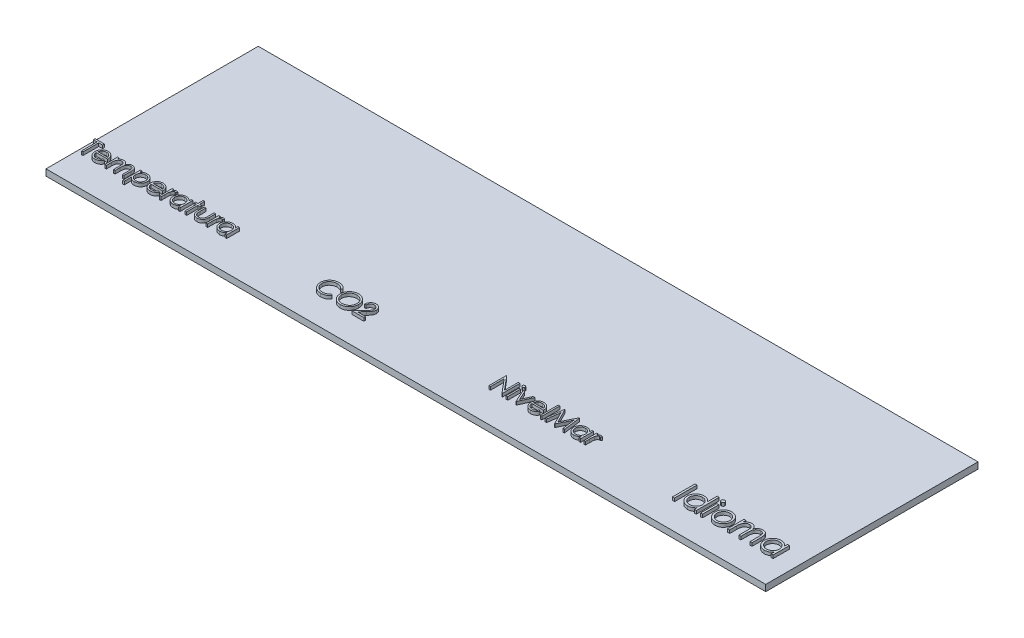
from build123d import *

# Parameters (mm, degrees)
CROQUIS1_W              = 226
CROQUIS1_H              = 66.65
SALIENTE_EXTRUIR1_DEPTH = 2
SALIENTE_EXTRUIR3_DEPTH = 1
SALIENTE_EXTRUIR4_DEPTH = 1
CROQUIS6_W              = 0.493589743
CROQUIS6_H              = 4.019230769
CROQUIS6_H_2            = 5.641025641
SALIENTE_EXTRUIR5_DEPTH = 1
CROQUIS7_W              = 0.628205129
CROQUIS7_H              = 7
CROQUIS7_W_2            = 0.628205128
CROQUIS7_H_2            = 5.115384615
SALIENTE_EXTRUIR6_DEPTH = 1


with BuildPart() as part:
    # Croquis1 → Saliente-Extruir1 (new body)
    with BuildSketch(Plane(origin=(0, 0, 0), x_dir=(1, 0, 0), z_dir=(0, 1, 0))):
        Rectangle(CROQUIS1_W, CROQUIS1_H)
    extrude(amount=SALIENTE_EXTRUIR1_DEPTH)

    # Croquis4 → Saliente-Extruir3 (add)
    # profile 1 of 11: a face of its own
    with BuildSketch(Plane(origin=(0, 2, 0), x_dir=(1, 0, 0), z_dir=(0, 1, 0))):
        Polygon((-112.494796183, -18.975280137), (-112.494796183, -18.411177573), (-109.603770542, -18.411177573), (-109.603770542, -18.975280137), (-110.802488491, -18.975280137), (-110.802488491, -23.911177573), (-111.296078235, -23.911177573), (-111.296078235, -18.975280137), align=None)
    # profile 2 of 11: a face of its own
    with BuildSketch(Plane(origin=(0, 2, 0), x_dir=(1, 0, 0), z_dir=(0, 1, 0))):
        with BuildLine():
            Line((-105.599964453, -22.641946804), (-105.16146285, -22.872215233))
            add(Edge.make_bspline(
                [(-105.16146285, -22.872215233), (-105.196406071, -22.934197611), (-105.264391742, -23.054790773), (-105.381307203, -23.22046941), (-105.503866174, -23.369515821), (-105.637600981, -23.497948135), (-105.778510476, -23.609914597), (-105.927376077, -23.707874036), (-106.08497279, -23.791345996), (-106.251308072, -23.861671397), (-106.427778795, -23.915743459), (-106.614812607, -23.953935807), (-106.812767814, -23.9775438), (-106.948454668, -23.980286164), (-107.017933203, -23.981690393)],
                knots=[0, 0, 0, 0, 1.120438281, 2.179929193, 3.190490725, 4.156257408, 5.095198341, 6.022838206, 6.959905092, 7.901321166, 8.864066838, 9.862729781, 10.905609505, 12, 12, 12, 12], degree=3))
            add(Edge.make_bspline(
                [(-107.017933203, -23.981690393), (-107.09515631, -23.979887689), (-107.245796221, -23.976371136), (-107.465072967, -23.946054406), (-107.671526339, -23.896597842), (-107.86514473, -23.827509134), (-108.045453984, -23.737266197), (-108.21281247, -23.627329868), (-108.368100296, -23.498264896), (-108.506424053, -23.348953342), (-108.630950155, -23.189167409), (-108.740833586, -23.022665305), (-108.832695264, -22.849865952), (-108.907420794, -22.671869415), (-108.967771296, -22.489797582), (-109.009833259, -22.301993847), (-109.034080006, -22.108966501), (-109.037795563, -21.978384973), (-109.039667978, -21.912579817)],
                knots=[0, 0, 0, 0, 1.145258523, 2.234067595, 3.276747158, 4.290159414, 5.277019952, 6.260822364, 7.254936242, 8.264827045, 9.274100331, 10.257902744, 11.220704747, 12.172965371, 13.118907548, 14.062713208, 15.023725156, 16, 16, 16, 16], degree=3))
            add(Edge.make_bspline(
                [(-109.039667978, -21.912579817), (-109.038003613, -21.850830797), (-109.034705062, -21.728452396), (-109.013913825, -21.547320826), (-108.977066507, -21.371276115), (-108.926503712, -21.200171982), (-108.861208897, -21.034294914), (-108.781329695, -20.873543957), (-108.686741673, -20.718090166), (-108.613713185, -20.620028099), (-108.576927594, -20.570632701)],
                knots=[0, 0, 0, 0, 1.024358464, 2.0301432, 3.019427413, 4.004406732, 4.986367066, 5.972626655, 6.978780325, 8, 8, 8, 8], degree=3))
            add(Edge.make_bspline(
                [(-108.576927594, -20.570632701), (-108.527101235, -20.511124477), (-108.42902689, -20.393993097), (-108.263152618, -20.240090014), (-108.083538023, -20.111164082), (-107.89243404, -20.004295725), (-107.68761958, -19.92309428), (-107.471847837, -19.862582365), (-107.242661916, -19.828674062), (-107.085982283, -19.823884609), (-107.005813812, -19.821433983)],
                knots=[0, 0, 0, 0, 1.030682036, 2.02871468, 2.997146059, 3.962720338, 4.930598197, 5.918074684, 6.934738563, 8, 8, 8, 8], degree=3))
            add(Edge.make_bspline(
                [(-107.005813812, -19.821433983), (-106.923396146, -19.823561774), (-106.761711474, -19.827736015), (-106.525946712, -19.866434539), (-106.302865586, -19.927802839), (-106.092557365, -20.014473082), (-105.895000727, -20.126295234), (-105.711479792, -20.264803842), (-105.538855987, -20.425746551), (-105.43842822, -20.549517309), (-105.387324228, -20.612499688)],
                knots=[0, 0, 0, 0, 1.056321875, 2.072262726, 3.055038591, 4.01806755, 4.982017516, 5.957941055, 6.960871419, 8, 8, 8, 8], degree=3))
            add(Edge.make_bspline(
                [(-105.387324228, -20.612499688), (-105.352553325, -20.659962459), (-105.283242965, -20.754572074), (-105.196426093, -20.908841035), (-105.121064473, -21.070243398), (-105.060826962, -21.24138815), (-105.012050603, -21.420247491), (-104.976761317, -21.608100061), (-104.956066202, -21.804889922), (-104.951998249, -21.938974509), (-104.949924389, -22.007331419)],
                knots=[0, 0, 0, 0, 0.94817472, 1.890038105, 2.849395472, 3.817997239, 4.812318967, 5.836947057, 6.897266129, 8, 8, 8, 8], degree=3))
            Line((-104.949924389, -22.007331419), (-108.546078235, -22.007331419))
            add(Edge.make_bspline(
                [(-108.546078235, -22.007331419), (-108.543658853, -22.060289292), (-108.538901237, -22.164428812), (-108.516720298, -22.316811471), (-108.481757939, -22.46196958), (-108.432620841, -22.59881436), (-108.373115798, -22.729133132), (-108.300223957, -22.85195919), (-108.213261801, -22.96673308), (-108.116264274, -23.074481439), (-108.008295981, -23.170434064), (-107.894708807, -23.256315427), (-107.773876062, -23.32829565), (-107.646750502, -23.386721191), (-107.513537697, -23.432459688), (-107.374195676, -23.463680549), (-107.228998636, -23.484591717), (-107.130021054, -23.486916905), (-107.079631921, -23.48810065)],
                knots=[0, 0, 0, 0, 1.094153842, 2.151609401, 3.174256925, 4.172055639, 5.149267565, 6.128595816, 7.11444997, 8.118368179, 9.117203808, 10.09244225, 11.054858984, 12.015122123, 12.976791628, 13.957293641, 14.960065497, 16, 16, 16, 16], degree=3))
            add(Edge.make_bspline(
                [(-107.079631921, -23.48810065), (-107.030365832, -23.487145132), (-106.93261246, -23.485249202), (-106.78703397, -23.466813342), (-106.643814713, -23.437002909), (-106.503547453, -23.396318639), (-106.369078981, -23.346697871), (-106.24455026, -23.286821952), (-106.130024206, -23.220586636), (-106.022983259, -23.144828575), (-105.919157412, -23.052101424), (-105.816162076, -22.936388148), (-105.705727335, -22.799536319), (-105.636600833, -22.696535986), (-105.599964453, -22.641946804)],
                knots=[0, 0, 0, 0, 0.99110716, 1.966546729, 2.947904876, 3.932708344, 4.903319531, 5.828989031, 6.710028674, 7.56322171, 8.463672341, 9.504779593, 10.677557249, 12, 12, 12, 12], degree=3))
        make_face()
        with BuildLine():
            add(Edge.make_bspline(
                [(-105.443514132, -21.513741676), (-105.461580256, -21.448271445), (-105.49635173, -21.322262327), (-105.569008874, -21.147769499), (-105.650835581, -20.992688512), (-105.74766973, -20.858206232), (-105.857384871, -20.73877214), (-105.984113015, -20.634400077), (-106.126226562, -20.541029797), (-106.282990926, -20.462218727), (-106.448999445, -20.395134663), (-106.622809175, -20.350152338), (-106.800157128, -20.319337343), (-106.920111006, -20.316467744), (-106.980473267, -20.315023727)],
                knots=[0, 0, 0, 0, 1.154881502, 2.222775134, 3.210006277, 4.132804581, 5.035138423, 5.962687519, 6.919655026, 7.923214229, 8.944639381, 9.960483929, 10.97369054, 12, 12, 12, 12], degree=3))
            add(Edge.make_bspline(
                [(-106.980473267, -20.315023727), (-107.02973667, -20.315984925), (-107.127120062, -20.317885012), (-107.270593169, -20.335909501), (-107.408375553, -20.365703542), (-107.541483862, -20.406505617), (-107.668173798, -20.460890564), (-107.791051291, -20.524664206), (-107.906991913, -20.602515266), (-107.979499663, -20.661850609), (-108.016130318, -20.691826611)],
                knots=[0, 0, 0, 0, 1.04873581, 2.073130211, 3.073294108, 4.04793562, 5.032784715, 6.005352987, 6.992311501, 8, 8, 8, 8], degree=3))
            add(Edge.make_bspline(
                [(-108.016130318, -20.691826611), (-108.042362618, -20.71554625), (-108.095450401, -20.763549018), (-108.166385506, -20.846252057), (-108.234303392, -20.935433083), (-108.296113417, -21.034503994), (-108.352806767, -21.142336646), (-108.40585816, -21.258021502), (-108.453608236, -21.382436421), (-108.480473552, -21.469135968), (-108.494295382, -21.513741676)],
                knots=[0, 0, 0, 0, 0.879870761, 1.780643979, 2.707998968, 3.669668524, 4.684282772, 5.740141944, 6.837334558, 8, 8, 8, 8], degree=3))
            Line((-108.494295382, -21.513741676), (-105.443514132, -21.513741676))
        make_face(mode=Mode.SUBTRACT)
    # profile 3 of 11: a face of its own
    with BuildSketch(Plane(origin=(0, 2, 0), x_dir=(1, 0, 0), z_dir=(0, 1, 0))):
        with BuildLine():
            Line((-103.962744901, -19.891946804), (-103.469155158, -19.891946804))
            Line((-103.469155158, -19.891946804), (-103.469155158, -20.590464432))
            add(Edge.make_bspline(
                [(-103.469155158, -20.590464432), (-103.424708951, -20.529355344), (-103.339545757, -20.412264472), (-103.199899732, -20.257965453), (-103.060394412, -20.12702121), (-102.959927669, -20.058282412), (-102.911663171, -20.025260105)],
                knots=[0, 0, 0, 0, 1.134379233, 2.173579362, 3.122582517, 4, 4, 4, 4], degree=3))
            add(Edge.make_bspline(
                [(-102.911663171, -20.025260105), (-102.845875844, -19.993823102), (-102.715450573, -19.931498339), (-102.508934648, -19.868274175), (-102.297617311, -19.829420444), (-102.154918689, -19.824106857), (-102.08313753, -19.821433983)],
                knots=[0, 0, 0, 0, 1.014936303, 2.012140481, 3.000054389, 4, 4, 4, 4], degree=3))
            add(Edge.make_bspline(
                [(-102.08313753, -19.821433983), (-102.034591392, -19.823076583), (-101.938521197, -19.8263272), (-101.796174769, -19.847478684), (-101.658111236, -19.884039813), (-101.525146333, -19.934965607), (-101.39987098, -19.996638973), (-101.285016526, -20.069002799), (-101.181892771, -20.150241061), (-101.090551833, -20.244022241), (-101.008414793, -20.352979753), (-100.93286232, -20.480052144), (-100.863051272, -20.628092754), (-100.824360643, -20.73552589), (-100.803990895, -20.792087028)],
                knots=[0, 0, 0, 0, 1.009824226, 1.998387844, 2.986035974, 3.974953746, 4.955485308, 5.885931332, 6.793869504, 7.679848016, 8.601185859, 9.625726857, 10.749998409, 12, 12, 12, 12], degree=3))
            add(Edge.make_bspline(
                [(-100.803990895, -20.792087028), (-100.782444643, -20.753234369), (-100.740044645, -20.676777793), (-100.668850072, -20.568571952), (-100.59425782, -20.467361279), (-100.515632188, -20.37306547), (-100.433250695, -20.286150179), (-100.346725637, -20.206328048), (-100.256549552, -20.133256283), (-100.131161747, -20.047891318), (-99.968027649, -19.957218033), (-99.762346326, -19.878601907), (-99.548396056, -19.83001942), (-99.403168245, -19.824314705), (-99.329832241, -19.821433983)],
                knots=[0, 0, 0, 0, 0.86119277, 1.694706429, 2.50939023, 3.298075842, 4.073795165, 4.829715201, 5.57930267, 6.321991688, 7.768977793, 9.186738141, 10.579381044, 12, 12, 12, 12], degree=3))
            add(Edge.make_bspline(
                [(-99.329832241, -19.821433983), (-99.262447085, -19.82397533), (-99.130567793, -19.828948993), (-98.938574946, -19.868004451), (-98.759523538, -19.935069325), (-98.593773847, -20.026579326), (-98.444236997, -20.141575185), (-98.314254226, -20.278397644), (-98.204615083, -20.436078909), (-98.132991507, -20.584409177), (-98.084410377, -20.7153647), (-98.054457009, -20.826946015), (-98.027994631, -20.949755598), (-98.006024103, -21.083940295), (-97.989966378, -21.229974108), (-97.978069539, -21.387618056), (-97.970017424, -21.55699466), (-97.969448453, -21.673854731), (-97.969155158, -21.73409424)],
                knots=[0, 0, 0, 0, 1.209669288, 2.367440248, 3.500751976, 4.631527125, 5.755587489, 6.87532382, 8.007944318, 9.190864318, 9.82315674, 10.514484317, 11.263564316, 12.079023757, 12.955305781, 13.901327259, 14.918167583, 16, 16, 16, 16], degree=3))
            Line((-97.969155158, -21.73409424), (-97.969155158, -23.911177573))
            Line((-97.969155158, -23.911177573), (-98.462744901, -23.911177573))
            Line((-98.462744901, -23.911177573), (-98.462744901, -21.731890714))
            add(Edge.make_bspline(
                [(-98.462744901, -21.731890714), (-98.462867289, -21.680472669), (-98.463102499, -21.581655007), (-98.467335349, -21.439829727), (-98.475310842, -21.310550879), (-98.484636703, -21.193994741), (-98.497591261, -21.089889502), (-98.514320582, -20.998444273), (-98.532042651, -20.918939712), (-98.561484922, -20.830804494), (-98.608545895, -20.733579878), (-98.680230506, -20.628728544), (-98.770540673, -20.537458716), (-98.874820919, -20.458229932), (-98.993539904, -20.393811353), (-99.124384469, -20.347806195), (-99.266542264, -20.319327386), (-99.364949503, -20.316489362), (-99.415769741, -20.315023727)],
                knots=[0, 0, 0, 0, 1.253487763, 2.409012846, 3.458416907, 4.410876679, 5.259312806, 6.014470957, 6.676830364, 7.243083969, 8.276244668, 9.299465089, 10.325150304, 11.392391894, 12.482080715, 13.603491619, 14.762376348, 16, 16, 16, 16], degree=3))
            add(Edge.make_bspline(
                [(-99.415769741, -20.315023727), (-99.478108241, -20.317249117), (-99.601312816, -20.321647334), (-99.781155723, -20.366549134), (-99.95396732, -20.434246671), (-100.1145911, -20.532354818), (-100.262349057, -20.649910818), (-100.389476965, -20.789688755), (-100.494498971, -20.947821497), (-100.565612362, -21.094194886), (-100.610538407, -21.225675441), (-100.640202131, -21.34054274), (-100.663276032, -21.471099489), (-100.684915435, -21.616468403), (-100.699039008, -21.777650115), (-100.711875021, -21.953899031), (-100.717879234, -22.145745253), (-100.718719098, -22.27873005), (-100.719155158, -22.347776131)],
                knots=[0, 0, 0, 0, 1.090531906, 2.155305635, 3.229839962, 4.33261226, 5.44038871, 6.529323825, 7.629011124, 8.757537029, 9.370236727, 10.061839251, 10.834451254, 11.692844982, 12.636905849, 13.66920014, 14.789842145, 16, 16, 16, 16], degree=3))
            Line((-100.719155158, -22.347776131), (-100.719155158, -23.911177573))
            Line((-100.719155158, -23.911177573), (-101.212744901, -23.911177573))
            Line((-101.212744901, -23.911177573), (-101.212744901, -21.867407541))
            add(Edge.make_bspline(
                [(-101.212744901, -21.867407541), (-101.212869722, -21.809746611), (-101.213109863, -21.698812779), (-101.217315504, -21.539731289), (-101.225308767, -21.395032449), (-101.234549629, -21.264884434), (-101.247844195, -21.149523775), (-101.26294525, -21.048332012), (-101.280778781, -20.961562832), (-101.310305742, -20.866391799), (-101.355428478, -20.761544634), (-101.428010033, -20.649751601), (-101.51853623, -20.551901733), (-101.624719035, -20.468366557), (-101.744156536, -20.399315658), (-101.876130451, -20.349564619), (-102.019452457, -20.320612164), (-102.118260281, -20.316921669), (-102.16907503, -20.315023727)],
                knots=[0, 0, 0, 0, 1.320475261, 2.540461679, 3.643808994, 4.639130445, 5.527981419, 6.302341397, 6.981980563, 7.553956391, 8.582137848, 9.585246428, 10.591171744, 11.620968678, 12.668337649, 13.738356861, 14.836885341, 16, 16, 16, 16], degree=3))
            add(Edge.make_bspline(
                [(-102.16907503, -20.315023727), (-102.22881479, -20.317428735), (-102.347874012, -20.322221832), (-102.522777108, -20.365364262), (-102.691683182, -20.432942094), (-102.851897709, -20.526693239), (-102.999099942, -20.642820362), (-103.127970076, -20.779400913), (-103.23630833, -20.934735108), (-103.308172611, -21.079565063), (-103.354527356, -21.207751637), (-103.385320025, -21.316731698), (-103.411782294, -21.437732088), (-103.431447185, -21.57112612), (-103.450430695, -21.716044982), (-103.45959261, -21.873210609), (-103.468505064, -22.042488175), (-103.468933145, -22.159359318), (-103.469155158, -22.219971643)],
                knots=[0, 0, 0, 0, 1.098833095, 2.189935336, 3.297829714, 4.440610912, 5.596351641, 6.740013378, 7.886572111, 9.072425424, 9.705826452, 10.395263256, 11.156850408, 11.985370555, 12.878090359, 13.847760091, 14.883794034, 16, 16, 16, 16], degree=3))
            Line((-103.469155158, -22.219971643), (-103.469155158, -23.911177573))
            Line((-103.469155158, -23.911177573), (-103.962744901, -23.911177573))
            Line((-103.962744901, -23.911177573), (-103.962744901, -19.891946804))
        make_face()
    # profile 4 of 11: a face of its own
    with BuildSketch(Plane(origin=(0, 2, 0), x_dir=(1, 0, 0), z_dir=(0, 1, 0))):
        with BuildLine():
            Line((-96.84095003, -19.891946804), (-96.347360286, -19.891946804))
            Line((-96.347360286, -19.891946804), (-96.347360286, -20.635636708))
            add(Edge.make_bspline(
                [(-96.347360286, -20.635636708), (-96.294941383, -20.568163126), (-96.193075734, -20.437041723), (-96.017508026, -20.267342949), (-95.832194469, -20.124224615), (-95.63236625, -20.012052063), (-95.421129022, -19.927476502), (-95.199349666, -19.864965937), (-94.965145893, -19.828129334), (-94.805022896, -19.823695295), (-94.723361889, -19.821433983)],
                knots=[0, 0, 0, 0, 1.0828784, 2.104357462, 3.088488658, 4.04616522, 5.001424249, 5.969181776, 6.964304535, 8, 8, 8, 8], degree=3))
            add(Edge.make_bspline(
                [(-94.723361889, -19.821433983), (-94.652032226, -19.82349755), (-94.511045402, -19.827576298), (-94.303517471, -19.855191098), (-94.10367044, -19.902518901), (-93.912634926, -19.970720339), (-93.728364395, -20.055036078), (-93.55358681, -20.161448562), (-93.385579794, -20.28465829), (-93.228568639, -20.42645167), (-93.083492205, -20.579867518), (-92.958019634, -20.744902567), (-92.849792356, -20.916129488), (-92.762310462, -21.096202776), (-92.693783059, -21.283704423), (-92.645045708, -21.479391973), (-92.61604084, -21.682539879), (-92.612149273, -21.820672726), (-92.610180799, -21.89054456)],
                knots=[0, 0, 0, 0, 1.041296284, 2.058176809, 3.050446431, 4.034000596, 5.01514041, 6.003636468, 7.015969324, 8.052561599, 9.08815499, 10.094063707, 11.074456064, 12.040834395, 13.011057502, 13.983766392, 14.980127149, 16, 16, 16, 16], degree=3))
            add(Edge.make_bspline(
                [(-92.610180799, -21.89054456), (-92.612106562, -21.961891045), (-92.615904444, -22.102596609), (-92.645360882, -22.309219191), (-92.69243597, -22.507985064), (-92.760098829, -22.698563621), (-92.847535454, -22.880823644), (-92.953928335, -23.054633695), (-93.079464211, -23.219938086), (-93.222937412, -23.374492643), (-93.378592026, -23.516862992), (-93.544970938, -23.641379959), (-93.719492107, -23.745944977), (-93.901262655, -23.833289628), (-94.091838658, -23.899120203), (-94.290330952, -23.946605318), (-94.496631468, -23.975888097), (-94.63696185, -23.979741464), (-94.707937209, -23.981690393)],
                knots=[0, 0, 0, 0, 1.038740735, 2.04854663, 3.033179607, 4.009277356, 4.987731542, 5.972001279, 6.972200261, 8.005528982, 9.039189865, 10.040446548, 11.026516639, 11.997840187, 12.972163198, 13.956796175, 14.96660207, 16, 16, 16, 16], degree=3))
            add(Edge.make_bspline(
                [(-94.707937209, -23.981690393), (-94.787809108, -23.979655696), (-94.945579525, -23.975636571), (-95.176261578, -23.934906069), (-95.39826806, -23.874033742), (-95.609139356, -23.784935323), (-95.810545918, -23.671390941), (-96.00134847, -23.532932046), (-96.18256051, -23.369848207), (-96.291631415, -23.246126782), (-96.347360286, -23.182912349)],
                knots=[0, 0, 0, 0, 1.014726462, 2.004382257, 2.969841629, 3.936926163, 4.907207904, 5.903978561, 6.929055279, 8, 8, 8, 8], degree=3))
            Line((-96.347360286, -23.182912349), (-96.347360286, -25.391946804))
            Line((-96.347360286, -25.391946804), (-96.84095003, -25.391946804))
            Line((-96.84095003, -25.391946804), (-96.84095003, -19.891946804))
        make_face()
        with BuildLine():
            add(Edge.make_bspline(
                [(-94.72776894, -20.315023727), (-94.783679681, -20.316029847), (-94.893753519, -20.318010638), (-95.055095577, -20.341541129), (-95.210502678, -20.375700436), (-95.358408602, -20.427419137), (-95.500230999, -20.490902986), (-95.634877544, -20.570231861), (-95.762253721, -20.663970727), (-95.882039055, -20.770323982), (-95.990252802, -20.887512777), (-96.086051688, -21.012579335), (-96.166520311, -21.145365268), (-96.2333092, -21.284633695), (-96.284134358, -21.431476286), (-96.320207632, -21.585056735), (-96.342883901, -21.74554314), (-96.345852231, -21.854845436), (-96.347360286, -21.910376291)],
                knots=[0, 0, 0, 0, 1.05670511, 2.080379991, 3.077984906, 4.06214886, 5.038337365, 6.01289324, 7.01187578, 8.025460281, 9.038092164, 10.024533457, 11.000252242, 11.969694649, 12.940728589, 13.933144304, 14.949937299, 16, 16, 16, 16], degree=3))
            add(Edge.make_bspline(
                [(-96.347360286, -21.910376291), (-96.344860369, -21.983271896), (-96.339962821, -22.126080561), (-96.300146957, -22.334741324), (-96.235348685, -22.532193926), (-96.143374992, -22.716775555), (-96.027171661, -22.886462868), (-95.887160272, -23.038405249), (-95.724607692, -23.171647606), (-95.542216391, -23.283881005), (-95.3466959, -23.375005109), (-95.142746609, -23.440241726), (-94.933173225, -23.480426656), (-94.791480151, -23.4855288), (-94.7200566, -23.48810065)],
                knots=[0, 0, 0, 0, 1.03728447, 2.032128127, 3.01272805, 3.987917167, 4.958271349, 5.931593992, 6.91984656, 7.941419022, 8.973179163, 9.983609215, 10.983593296, 12, 12, 12, 12], degree=3))
            add(Edge.make_bspline(
                [(-94.7200566, -23.48810065), (-94.650071822, -23.485654915), (-94.511164619, -23.48080057), (-94.306630428, -23.438783418), (-94.107859425, -23.37459838), (-93.919004868, -23.281004791), (-93.741710816, -23.166306128), (-93.581611231, -23.028711791), (-93.441743224, -22.869227594), (-93.322527809, -22.691642804), (-93.226464047, -22.501224344), (-93.154287955, -22.304196448), (-93.112631626, -22.10125364), (-93.106728101, -21.964542948), (-93.103770542, -21.896053374)],
                knots=[0, 0, 0, 0, 1.00104056, 1.986885549, 2.97790532, 3.984399681, 4.995088187, 5.994304198, 6.996462723, 8.023150851, 9.048424203, 10.043036403, 11.019596776, 12, 12, 12, 12], degree=3))
            add(Edge.make_bspline(
                [(-93.103770542, -21.896053374), (-93.106056553, -21.827138391), (-93.110610763, -21.689845343), (-93.155470394, -21.487503638), (-93.222884644, -21.289679676), (-93.321191726, -21.101861669), (-93.437793721, -20.924645253), (-93.578824716, -20.768203443), (-93.736935882, -20.631220958), (-93.914018854, -20.518053885), (-94.104068094, -20.428033822), (-94.30413439, -20.362216675), (-94.513202908, -20.322657926), (-94.655617794, -20.317590844), (-94.72776894, -20.315023727)],
                knots=[0, 0, 0, 0, 0.983928682, 1.960191568, 2.949917689, 3.96440592, 4.982380491, 5.975291189, 6.965713506, 7.964880129, 8.970154049, 9.96478489, 10.968906225, 12, 12, 12, 12], degree=3))
        make_face(mode=Mode.SUBTRACT)
    # profile 5 of 11: a face of its own
    with BuildSketch(Plane(origin=(0, 2, 0), x_dir=(1, 0, 0), z_dir=(0, 1, 0))):
        with BuildLine():
            Line((-88.324323427, -22.641946804), (-87.885821824, -22.872215233))
            add(Edge.make_bspline(
                [(-87.885821824, -22.872215233), (-87.920765046, -22.934197611), (-87.988750716, -23.054790773), (-88.105666177, -23.22046941), (-88.228225148, -23.369515821), (-88.361959955, -23.497948135), (-88.502869451, -23.609914597), (-88.651735051, -23.707874036), (-88.809331765, -23.791345996), (-88.975667046, -23.861671397), (-89.15213777, -23.915743459), (-89.339171581, -23.953935807), (-89.537126788, -23.9775438), (-89.672813642, -23.980286164), (-89.742292177, -23.981690393)],
                knots=[0, 0, 0, 0, 1.120438281, 2.179929193, 3.190490725, 4.156257408, 5.095198341, 6.022838206, 6.959905092, 7.901321166, 8.864066838, 9.862729781, 10.905609505, 12, 12, 12, 12], degree=3))
            add(Edge.make_bspline(
                [(-89.742292177, -23.981690393), (-89.819515285, -23.979887689), (-89.970155196, -23.976371136), (-90.189431941, -23.946054406), (-90.395885313, -23.896597842), (-90.589503704, -23.827509134), (-90.769812958, -23.737266197), (-90.937171444, -23.627329868), (-91.092459271, -23.498264896), (-91.230783028, -23.348953342), (-91.355309129, -23.189167409), (-91.465192561, -23.022665305), (-91.557054238, -22.849865952), (-91.631779768, -22.671869415), (-91.69213027, -22.489797582), (-91.734192233, -22.301993847), (-91.75843898, -22.108966501), (-91.762154538, -21.978384973), (-91.764026953, -21.912579817)],
                knots=[0, 0, 0, 0, 1.145258523, 2.234067595, 3.276747158, 4.290159414, 5.277019952, 6.260822364, 7.254936242, 8.264827045, 9.274100331, 10.257902744, 11.220704747, 12.172965371, 13.118907548, 14.062713208, 15.023725156, 16, 16, 16, 16], degree=3))
            add(Edge.make_bspline(
                [(-91.764026953, -21.912579817), (-91.762362588, -21.850830797), (-91.759064036, -21.728452396), (-91.738272799, -21.547320826), (-91.701425481, -21.371276115), (-91.650862686, -21.200171982), (-91.585567871, -21.034294914), (-91.505688669, -20.873543957), (-91.411100647, -20.718090166), (-91.33807216, -20.620028099), (-91.301286568, -20.570632701)],
                knots=[0, 0, 0, 0, 1.024358464, 2.0301432, 3.019427413, 4.004406732, 4.986367066, 5.972626655, 6.978780325, 8, 8, 8, 8], degree=3))
            add(Edge.make_bspline(
                [(-91.301286568, -20.570632701), (-91.251460209, -20.511124477), (-91.153385865, -20.393993097), (-90.987511592, -20.240090014), (-90.807896998, -20.111164082), (-90.616793014, -20.004295725), (-90.411978555, -19.92309428), (-90.196206812, -19.862582365), (-89.96702089, -19.828674062), (-89.810341258, -19.823884609), (-89.730172786, -19.821433983)],
                knots=[0, 0, 0, 0, 1.030682036, 2.02871468, 2.997146059, 3.962720338, 4.930598197, 5.918074684, 6.934738563, 8, 8, 8, 8], degree=3))
            add(Edge.make_bspline(
                [(-89.730172786, -19.821433983), (-89.647755121, -19.823561774), (-89.486070448, -19.827736015), (-89.250305687, -19.866434539), (-89.027224561, -19.927802839), (-88.81691634, -20.014473082), (-88.619359701, -20.126295234), (-88.435838766, -20.264803842), (-88.263214961, -20.425746551), (-88.162787194, -20.549517309), (-88.111683203, -20.612499688)],
                knots=[0, 0, 0, 0, 1.056321875, 2.072262726, 3.055038591, 4.01806755, 4.982017516, 5.957941055, 6.960871419, 8, 8, 8, 8], degree=3))
            add(Edge.make_bspline(
                [(-88.111683203, -20.612499688), (-88.0769123, -20.659962459), (-88.007601939, -20.754572074), (-87.920785068, -20.908841035), (-87.845423447, -21.070243398), (-87.785185937, -21.24138815), (-87.736409578, -21.420247491), (-87.701120291, -21.608100061), (-87.680425176, -21.804889922), (-87.676357223, -21.938974509), (-87.674283363, -22.007331419)],
                knots=[0, 0, 0, 0, 0.94817472, 1.890038105, 2.849395472, 3.817997239, 4.812318967, 5.836947057, 6.897266129, 8, 8, 8, 8], degree=3))
            Line((-87.674283363, -22.007331419), (-91.270437209, -22.007331419))
            add(Edge.make_bspline(
                [(-91.270437209, -22.007331419), (-91.268017828, -22.060289292), (-91.263260211, -22.164428812), (-91.241079272, -22.316811471), (-91.206116913, -22.46196958), (-91.156979815, -22.59881436), (-91.097474772, -22.729133132), (-91.024582932, -22.85195919), (-90.937620775, -22.96673308), (-90.840623248, -23.074481439), (-90.732654955, -23.170434064), (-90.619067781, -23.256315427), (-90.498235036, -23.32829565), (-90.371109476, -23.386721191), (-90.237896671, -23.432459688), (-90.09855465, -23.463680549), (-89.95335761, -23.484591717), (-89.854380028, -23.486916905), (-89.803990895, -23.48810065)],
                knots=[0, 0, 0, 0, 1.094153842, 2.151609401, 3.174256925, 4.172055639, 5.149267565, 6.128595816, 7.11444997, 8.118368179, 9.117203808, 10.09244225, 11.054858984, 12.015122123, 12.976791628, 13.957293641, 14.960065497, 16, 16, 16, 16], degree=3))
            add(Edge.make_bspline(
                [(-89.803990895, -23.48810065), (-89.754724806, -23.487145132), (-89.656971434, -23.485249202), (-89.511392944, -23.466813342), (-89.368173687, -23.437002909), (-89.227906428, -23.396318639), (-89.093437955, -23.346697871), (-88.968909234, -23.286821952), (-88.854383181, -23.220586636), (-88.747342233, -23.144828575), (-88.643516387, -23.052101424), (-88.540521051, -22.936388148), (-88.43008631, -22.799536319), (-88.360959807, -22.696535986), (-88.324323427, -22.641946804)],
                knots=[0, 0, 0, 0, 0.99110716, 1.966546729, 2.947904876, 3.932708344, 4.903319531, 5.828989031, 6.710028674, 7.56322171, 8.463672341, 9.504779593, 10.677557249, 12, 12, 12, 12], degree=3))
        make_face()
        with BuildLine():
            add(Edge.make_bspline(
                [(-88.167873107, -21.513741676), (-88.185939231, -21.448271445), (-88.220710705, -21.322262327), (-88.293367849, -21.147769499), (-88.375194556, -20.992688512), (-88.472028705, -20.858206232), (-88.581743845, -20.73877214), (-88.708471989, -20.634400077), (-88.850585536, -20.541029797), (-89.0073499, -20.462218727), (-89.17335842, -20.395134663), (-89.34716815, -20.350152338), (-89.524516102, -20.319337343), (-89.644469981, -20.316467744), (-89.704832241, -20.315023727)],
                knots=[0, 0, 0, 0, 1.154881502, 2.222775134, 3.210006277, 4.132804581, 5.035138423, 5.962687519, 6.919655026, 7.923214229, 8.944639381, 9.960483929, 10.97369054, 12, 12, 12, 12], degree=3))
            add(Edge.make_bspline(
                [(-89.704832241, -20.315023727), (-89.754095645, -20.315984925), (-89.851479036, -20.317885012), (-89.994952143, -20.335909501), (-90.132734527, -20.365703542), (-90.265842836, -20.406505617), (-90.392532772, -20.460890564), (-90.515410265, -20.524664206), (-90.631350888, -20.602515266), (-90.703858638, -20.661850609), (-90.740489292, -20.691826611)],
                knots=[0, 0, 0, 0, 1.04873581, 2.073130211, 3.073294108, 4.04793562, 5.032784715, 6.005352987, 6.992311501, 8, 8, 8, 8], degree=3))
            add(Edge.make_bspline(
                [(-90.740489292, -20.691826611), (-90.766721593, -20.71554625), (-90.819809375, -20.763549018), (-90.89074448, -20.846252057), (-90.958662366, -20.935433083), (-91.020472392, -21.034503994), (-91.077165742, -21.142336646), (-91.130217134, -21.258021502), (-91.177967211, -21.382436421), (-91.204832526, -21.469135968), (-91.218654357, -21.513741676)],
                knots=[0, 0, 0, 0, 0.879870761, 1.780643979, 2.707998968, 3.669668524, 4.684282772, 5.740141944, 6.837334558, 8, 8, 8, 8], degree=3))
            Line((-91.218654357, -21.513741676), (-88.167873107, -21.513741676))
        make_face(mode=Mode.SUBTRACT)
    # profile 6 of 11: a face of its own
    with BuildSketch(Plane(origin=(0, 2, 0), x_dir=(1, 0, 0), z_dir=(0, 1, 0))):
        with BuildLine():
            Line((-86.828129517, -19.891946804), (-86.334539773, -19.891946804))
            Line((-86.334539773, -19.891946804), (-86.334539773, -20.483593438))
            add(Edge.make_bspline(
                [(-86.334539773, -20.483593438), (-86.298100295, -20.428505708), (-86.228410077, -20.323150852), (-86.112575473, -20.183813379), (-85.993927381, -20.068446877), (-85.871897801, -19.976512776), (-85.745589359, -19.90766359), (-85.617774149, -19.857231677), (-85.486441267, -19.827410182), (-85.398186815, -19.823428718), (-85.353970863, -19.821433983)],
                knots=[0, 0, 0, 0, 1.2804753, 2.448899062, 3.506932113, 4.484331642, 5.4025378, 6.288909075, 7.142734305, 8, 8, 8, 8], degree=3))
            add(Edge.make_bspline(
                [(-85.353970863, -19.821433983), (-85.31967235, -19.823304811), (-85.24910093, -19.82715416), (-85.142271146, -19.854199741), (-85.032202865, -19.897379491), (-84.961264828, -19.937985555), (-84.924283363, -19.959154336)],
                knots=[0, 0, 0, 0, 0.901110191, 1.854092781, 2.881294221, 4, 4, 4, 4], degree=3))
            Line((-84.924283363, -19.959154336), (-85.195317017, -20.38663831))
            add(Edge.make_bspline(
                [(-85.195317017, -20.38663831), (-85.219059764, -20.376046463), (-85.264128044, -20.355941111), (-85.330056648, -20.332146523), (-85.390841606, -20.318135798), (-85.429567198, -20.316013242), (-85.447620703, -20.315023727)],
                knots=[0, 0, 0, 0, 1.180555205, 2.24091978, 3.179933427, 4, 4, 4, 4], degree=3))
            add(Edge.make_bspline(
                [(-85.447620703, -20.315023727), (-85.487229713, -20.317663786), (-85.568020611, -20.32304874), (-85.68663911, -20.365381152), (-85.801741862, -20.433777958), (-85.893154474, -20.509632562), (-85.963935157, -20.582779101), (-86.014441226, -20.646655163), (-86.060771257, -20.718278726), (-86.105038746, -20.796425372), (-86.145371494, -20.882429416), (-86.183014545, -20.975431609), (-86.217049901, -21.075539668), (-86.236457428, -21.145283628), (-86.246398748, -21.181009304)],
                knots=[0, 0, 0, 0, 1.125678352, 2.296057538, 3.5422874, 4.923748041, 5.663163013, 6.437101912, 7.23742474, 8.08941207, 8.991984279, 9.93940061, 10.944477711, 12, 12, 12, 12], degree=3))
            add(Edge.make_bspline(
                [(-86.246398748, -21.181009304), (-86.253835366, -21.212873434), (-86.27030691, -21.28345006), (-86.286322184, -21.401854885), (-86.302145712, -21.541749206), (-86.313297541, -21.703522423), (-86.323634464, -21.886770549), (-86.329464593, -22.091772749), (-86.334340957, -22.318739444), (-86.334471491, -22.477413428), (-86.334539773, -22.560416355)],
                knots=[0, 0, 0, 0, 0.566838948, 1.255505196, 2.06880316, 3.007127437, 4.065329342, 5.249902469, 6.561414163, 8, 8, 8, 8], degree=3))
            Line((-86.334539773, -22.560416355), (-86.334539773, -23.911177573))
            Line((-86.334539773, -23.911177573), (-86.828129517, -23.911177573))
            Line((-86.828129517, -23.911177573), (-86.828129517, -19.891946804))
        make_face()
    # profile 7 of 11: a face of its own
    with BuildSketch(Plane(origin=(0, 2, 0), x_dir=(1, 0, 0), z_dir=(0, 1, 0))):
        with BuildLine():
            Line((-80.34095003, -19.891946804), (-80.34095003, -23.911177573))
            Line((-80.34095003, -23.911177573), (-80.834539773, -23.911177573))
            Line((-80.834539773, -23.911177573), (-80.834539773, -23.215965233))
            add(Edge.make_bspline(
                [(-80.834539773, -23.215965233), (-80.890197873, -23.278884595), (-80.998815354, -23.401672521), (-81.180222825, -23.562087364), (-81.372515676, -23.694681869), (-81.574760609, -23.801774594), (-81.786774992, -23.882219254), (-82.008088843, -23.939397504), (-82.238792442, -23.976159245), (-82.396331856, -23.979830136), (-82.476166376, -23.981690393)],
                knots=[0, 0, 0, 0, 1.074387032, 2.096679803, 3.090159297, 4.057316773, 5.018401886, 5.985159533, 6.978961417, 8, 8, 8, 8], degree=3))
            add(Edge.make_bspline(
                [(-82.476166376, -23.981690393), (-82.547144589, -23.979763237), (-82.687116768, -23.975962799), (-82.893019604, -23.946479179), (-83.091164567, -23.89913106), (-83.281738895, -23.833286805), (-83.46350941, -23.745945513), (-83.638032419, -23.641380695), (-83.804403792, -23.516859391), (-83.960087639, -23.374506775), (-84.103452211, -23.219886081), (-84.229262782, -23.05497165), (-84.334160479, -22.880476601), (-84.421877749, -22.698610216), (-84.489443433, -22.507972485), (-84.536544858, -22.30922265), (-84.565994132, -22.102595706), (-84.569792998, -21.961890741), (-84.57171926, -21.89054456)],
                knots=[0, 0, 0, 0, 1.033919861, 2.038935746, 3.024066025, 3.998881131, 4.97069526, 5.957263378, 6.95902576, 7.993208707, 9.027059324, 10.027763471, 11.009749337, 11.988697705, 12.965288445, 13.950418724, 14.960734635, 16, 16, 16, 16], degree=3))
            add(Edge.make_bspline(
                [(-84.57171926, -21.89054456), (-84.569750305, -21.820673026), (-84.565857787, -21.682540772), (-84.536859871, -21.479388532), (-84.488096857, -21.28371698), (-84.419664525, -21.096156069), (-84.331912881, -20.916478847), (-84.225168745, -20.744558237), (-84.099424406, -20.579920612), (-83.954456338, -20.426437256), (-83.797415985, -20.284662005), (-83.62941655, -20.16144779), (-83.454637108, -20.055035599), (-83.270366663, -19.970722994), (-83.079332641, -19.902508687), (-82.879834369, -19.855314023), (-82.672701889, -19.827503946), (-82.532073972, -19.823476745), (-82.460741696, -19.821433983)],
                knots=[0, 0, 0, 0, 1.020392517, 2.01726096, 2.990465484, 3.961182959, 4.928053699, 5.906110375, 6.912531644, 7.948652711, 8.985773172, 9.998621852, 10.987621588, 11.969261332, 12.953316658, 13.946091881, 14.958173133, 16, 16, 16, 16], degree=3))
            add(Edge.make_bspline(
                [(-82.460741696, -19.821433983), (-82.378713346, -19.823693307), (-82.217859624, -19.828123735), (-81.982572752, -19.864993735), (-81.759988572, -19.927282754), (-81.548388876, -20.012010251), (-81.348533512, -20.124601111), (-81.162314537, -20.266626764), (-80.987783063, -20.437191487), (-80.886614033, -20.568202185), (-80.834539773, -20.635636708)],
                knots=[0, 0, 0, 0, 1.038897134, 2.037228247, 3.008116434, 3.962042015, 4.918381754, 5.904844433, 6.921570401, 8, 8, 8, 8], degree=3))
            Line((-80.834539773, -20.635636708), (-80.834539773, -19.891946804))
            Line((-80.834539773, -19.891946804), (-80.34095003, -19.891946804))
        make_face()
        with BuildLine():
            add(Edge.make_bspline(
                [(-82.454131119, -20.315023727), (-82.526282222, -20.317590872), (-82.668697022, -20.322658008), (-82.877766168, -20.362216357), (-83.077830104, -20.428035006), (-83.267888221, -20.518049422), (-83.444938276, -20.631237436), (-83.603171187, -20.768142467), (-83.743881146, -20.925029204), (-83.862222704, -21.101189663), (-83.958693485, -21.290040949), (-84.026527392, -21.48745078), (-84.071264781, -21.689858602), (-84.075835314, -21.827142823), (-84.078129517, -21.896053374)],
                knots=[0, 0, 0, 0, 1.031046209, 2.035121221, 3.029706178, 4.034933723, 5.034054252, 6.02443088, 7.017295772, 8.038157696, 9.050218397, 10.03989886, 11.016116709, 12, 12, 12, 12], degree=3))
            add(Edge.make_bspline(
                [(-84.078129517, -21.896053374), (-84.07519897, -21.964552114), (-84.069349364, -22.101281102), (-84.027312558, -22.303964865), (-83.956787043, -22.501421217), (-83.860549516, -22.691974207), (-83.740041962, -22.868892079), (-83.600359794, -23.028769414), (-83.440152209, -23.166253053), (-83.262694698, -23.281340669), (-83.073167888, -23.374310345), (-82.873857424, -23.438999207), (-82.668509992, -23.48076429), (-82.528884896, -23.485642754), (-82.458538171, -23.48810065)],
                knots=[0, 0, 0, 0, 0.979072187, 1.954306742, 2.945804271, 3.96968567, 4.997920485, 5.998718438, 6.996577872, 8.005894225, 9.015743152, 10.005417472, 10.995077863, 12, 12, 12, 12], degree=3))
            add(Edge.make_bspline(
                [(-82.458538171, -23.48810065), (-82.387122238, -23.485492135), (-82.24508303, -23.480304058), (-82.035393632, -23.440576355), (-81.831901548, -23.374939672), (-81.63737876, -23.28395533), (-81.456167697, -23.171193771), (-81.293528175, -23.039182628), (-81.156003082, -22.885649053), (-81.039414696, -22.716914627), (-80.947996184, -22.531938632), (-80.881405233, -22.334984904), (-80.84203481, -22.126046585), (-80.837072663, -21.983260415), (-80.834539773, -21.910376291)],
                knots=[0, 0, 0, 0, 1.01762866, 2.023962475, 3.030623092, 4.058876274, 5.077231937, 6.066672613, 7.034107872, 8.005628644, 8.981990164, 9.965428785, 10.961468474, 12, 12, 12, 12], degree=3))
            add(Edge.make_bspline(
                [(-80.834539773, -21.910376291), (-80.836047805, -21.854845414), (-80.839016088, -21.745543076), (-80.861692697, -21.585056977), (-80.897764724, -21.431475408), (-80.94859442, -21.284636896), (-81.015366438, -21.145353301), (-81.095898642, -21.012624535), (-81.191607206, -20.887140917), (-81.300951442, -20.770630377), (-81.420639618, -20.664360222), (-81.547288182, -20.569502129), (-81.682397641, -20.491576915), (-81.823695842, -20.427083488), (-81.971427939, -20.375761967), (-82.126796056, -20.341524162), (-82.28814875, -20.318015087), (-82.398221123, -20.316031345), (-82.454131119, -20.315023727)],
                knots=[0, 0, 0, 0, 1.050140795, 2.067009409, 3.05949893, 4.030605086, 5.00011959, 5.97591094, 6.962425594, 7.979863591, 8.993523472, 9.986985069, 10.967611495, 11.937549037, 12.921786183, 13.919465291, 14.943216303, 16, 16, 16, 16], degree=3))
        make_face(mode=Mode.SUBTRACT)
    # profile 8 of 11: a face of its own
    with BuildSketch(Plane(origin=(0, 2, 0), x_dir=(1, 0, 0), z_dir=(0, 1, 0))):
        Polygon((-78.719155158, -18.270151932), (-78.225565414, -18.270151932), (-78.225565414, -19.891946804), (-77.520437209, -19.891946804), (-77.520437209, -20.385536547), (-78.225565414, -20.385536547), (-78.225565414, -23.911177573), (-78.719155158, -23.911177573), (-78.719155158, -20.385536547), (-79.424283363, -20.385536547), (-79.424283363, -19.891946804), (-78.719155158, -19.891946804), align=None)
    # profile 9 of 11: a face of its own
    with BuildSketch(Plane(origin=(0, 2, 0), x_dir=(1, 0, 0), z_dir=(0, 1, 0))):
        with BuildLine():
            Line((-76.744796183, -19.891946804), (-76.25120644, -19.891946804))
            Line((-76.25120644, -19.891946804), (-76.25120644, -21.756129496))
            add(Edge.make_bspline(
                [(-76.25120644, -21.756129496), (-76.250983446, -21.810850959), (-76.25055687, -21.915530555), (-76.247663963, -22.066160134), (-76.24085953, -22.203529254), (-76.232352092, -22.327717268), (-76.221411592, -22.43870317), (-76.208394883, -22.536099302), (-76.193845935, -22.621010163), (-76.179604527, -22.672149722), (-76.17298128, -22.695933182)],
                knots=[0, 0, 0, 0, 1.388932606, 2.656963016, 3.823490214, 4.879454478, 5.816252168, 6.653371382, 7.373723809, 8, 8, 8, 8], degree=3))
            add(Edge.make_bspline(
                [(-76.17298128, -22.695933182), (-76.162356136, -22.725826265), (-76.141326743, -22.784990961), (-76.103182697, -22.870459398), (-76.055995311, -22.949620556), (-76.004358439, -23.025526956), (-75.944802227, -23.095930078), (-75.878080201, -23.160711032), (-75.806425828, -23.222317461), (-75.699953649, -23.295207849), (-75.554346231, -23.373331939), (-75.363177615, -23.440739654), (-75.155899546, -23.481024514), (-75.012640701, -23.485698343), (-74.939006921, -23.48810065)],
                knots=[0, 0, 0, 0, 0.725840625, 1.436591201, 2.137033971, 2.831655856, 3.53531722, 4.242432219, 4.957935707, 5.694543706, 7.190802206, 8.724350549, 10.316345118, 12, 12, 12, 12], degree=3))
            add(Edge.make_bspline(
                [(-74.939006921, -23.48810065), (-74.86537998, -23.485647259), (-74.722925473, -23.480900402), (-74.517924807, -23.441954842), (-74.330529727, -23.376888759), (-74.162621089, -23.28604854), (-74.014960483, -23.174882442), (-73.891910682, -23.044440028), (-73.790384996, -22.898848134), (-73.746055907, -22.790224267), (-73.72376253, -22.735596643)],
                knots=[0, 0, 0, 0, 1.157059328, 2.238695713, 3.266970494, 4.264342957, 5.228770407, 6.160125903, 7.074715775, 8, 8, 8, 8], degree=3))
            add(Edge.make_bspline(
                [(-73.72376253, -22.735596643), (-73.717171597, -22.713649603), (-73.702600654, -22.665130056), (-73.68694553, -22.582819022), (-73.672842804, -22.484660358), (-73.66080067, -22.370011745), (-73.652212558, -22.239172791), (-73.647583087, -22.092184385), (-73.642352941, -21.929507962), (-73.642273558, -21.815630055), (-73.642232081, -21.756129496)],
                knots=[0, 0, 0, 0, 0.557542046, 1.232589297, 2.036731608, 2.971723315, 4.038036528, 5.22795436, 6.551621927, 8, 8, 8, 8], degree=3))
            Line((-73.642232081, -21.756129496), (-73.642232081, -19.891946804))
            Line((-73.642232081, -19.891946804), (-73.148642337, -19.891946804))
            Line((-73.148642337, -19.891946804), (-73.148642337, -21.848677573))
            add(Edge.make_bspline(
                [(-73.148642337, -21.848677573), (-73.149336429, -21.915160271), (-73.150683062, -22.044145799), (-73.159337459, -22.23159226), (-73.174186851, -22.406275788), (-73.196725355, -22.568288848), (-73.223228558, -22.717507748), (-73.257416987, -22.854123734), (-73.298239932, -22.97771589), (-73.344291456, -23.090452968), (-73.398697248, -23.192669516), (-73.45656828, -23.289682942), (-73.523392922, -23.379086126), (-73.593746147, -23.465329485), (-73.672005892, -23.544123314), (-73.75670567, -23.617275633), (-73.84665333, -23.685904683), (-73.943844927, -23.747333836), (-74.046861597, -23.802674279), (-74.155830515, -23.851728116), (-74.272086369, -23.890546451), (-74.394129228, -23.92403464), (-74.522557024, -23.950300234), (-74.657245947, -23.968821982), (-74.79815063, -23.980176074), (-74.894179781, -23.981177144), (-74.943413972, -23.981690393)],
                knots=[0, 0, 0, 0, 1.493040784, 2.896703357, 4.213163133, 5.428574705, 6.569057535, 7.615249723, 8.588095153, 9.490268104, 10.346124644, 11.18633936, 12.024365274, 12.850166724, 13.684164916, 14.514361689, 15.362232829, 16.222528818, 17.093394965, 17.986930858, 18.902426812, 19.842810585, 20.827885679, 21.843828298, 22.894529745, 24, 24, 24, 24], degree=3))
            add(Edge.make_bspline(
                [(-74.943413972, -23.981690393), (-74.992279923, -23.981156568), (-75.088306065, -23.980107551), (-75.22921802, -23.96888471), (-75.364280116, -23.950329014), (-75.493012171, -23.923842244), (-75.615543366, -23.890780848), (-75.732370029, -23.851489578), (-75.842124199, -23.802648821), (-75.946124491, -23.747684088), (-76.043556816, -23.685510083), (-76.134870296, -23.617360307), (-76.219942492, -23.543336494), (-76.298792171, -23.463747789), (-76.370312563, -23.377606889), (-76.435394914, -23.285606723), (-76.495041165, -23.18865887), (-76.549024121, -23.084845329), (-76.595399737, -22.970803599), (-76.636343695, -22.844622447), (-76.669831841, -22.704918492), (-76.697084291, -22.551811175), (-76.719007983, -22.386033253), (-76.734229064, -22.206625743), (-76.742739655, -22.014025656), (-76.744095895, -21.8810044), (-76.744796183, -21.8123194)],
                knots=[0, 0, 0, 0, 1.083640291, 2.129454052, 3.13281866, 4.105697902, 5.042300162, 5.946461698, 6.836384745, 7.703652036, 8.553297018, 9.397182691, 10.228592656, 11.052265423, 11.879314572, 12.708807002, 13.549817954, 14.402308542, 15.300838682, 16.27712199, 17.341985831, 18.484375296, 19.725102775, 21.0496083, 22.476576903, 24, 24, 24, 24], degree=3))
            Line((-76.744796183, -21.8123194), (-76.744796183, -19.891946804))
        make_face()
    # profile 10 of 11: a face of its own
    with BuildSketch(Plane(origin=(0, 2, 0), x_dir=(1, 0, 0), z_dir=(0, 1, 0))):
        with BuildLine():
            Line((-72.16146285, -19.891946804), (-71.667873107, -19.891946804))
            Line((-71.667873107, -19.891946804), (-71.667873107, -20.483593438))
            add(Edge.make_bspline(
                [(-71.667873107, -20.483593438), (-71.631433629, -20.428505708), (-71.56174341, -20.323150852), (-71.445908807, -20.183813379), (-71.327260715, -20.068446877), (-71.205231135, -19.976512776), (-71.078922692, -19.90766359), (-70.951107482, -19.857231677), (-70.819774601, -19.827410182), (-70.731520148, -19.823428718), (-70.687304196, -19.821433983)],
                knots=[0, 0, 0, 0, 1.2804753, 2.448899062, 3.506932113, 4.484331642, 5.4025378, 6.288909075, 7.142734305, 8, 8, 8, 8], degree=3))
            add(Edge.make_bspline(
                [(-70.687304196, -19.821433983), (-70.653005683, -19.823304811), (-70.582434264, -19.82715416), (-70.47560448, -19.854199741), (-70.365536198, -19.897379491), (-70.294598161, -19.937985555), (-70.257616696, -19.959154336)],
                knots=[0, 0, 0, 0, 0.901110191, 1.854092781, 2.881294221, 4, 4, 4, 4], degree=3))
            Line((-70.257616696, -19.959154336), (-70.52865035, -20.38663831))
            add(Edge.make_bspline(
                [(-70.52865035, -20.38663831), (-70.552393098, -20.376046463), (-70.597461378, -20.355941111), (-70.663389982, -20.332146523), (-70.724174939, -20.318135798), (-70.762900531, -20.316013242), (-70.780954036, -20.315023727)],
                knots=[0, 0, 0, 0, 1.180555205, 2.24091978, 3.179933427, 4, 4, 4, 4], degree=3))
            add(Edge.make_bspline(
                [(-70.780954036, -20.315023727), (-70.820563046, -20.317663786), (-70.901353944, -20.32304874), (-71.019972443, -20.365381152), (-71.135075195, -20.433777958), (-71.226487807, -20.509632562), (-71.29726849, -20.582779101), (-71.347774559, -20.646655163), (-71.39410459, -20.718278726), (-71.438372079, -20.796425372), (-71.478704827, -20.882429416), (-71.516347879, -20.975431609), (-71.550383235, -21.075539668), (-71.569790761, -21.145283628), (-71.579732081, -21.181009304)],
                knots=[0, 0, 0, 0, 1.125678352, 2.296057538, 3.5422874, 4.923748041, 5.663163013, 6.437101912, 7.23742474, 8.08941207, 8.991984279, 9.93940061, 10.944477711, 12, 12, 12, 12], degree=3))
            add(Edge.make_bspline(
                [(-71.579732081, -21.181009304), (-71.587168699, -21.212873434), (-71.603640243, -21.28345006), (-71.619655517, -21.401854885), (-71.635479045, -21.541749206), (-71.646630874, -21.703522423), (-71.656967797, -21.886770549), (-71.662797927, -22.091772749), (-71.66767429, -22.318739444), (-71.667804824, -22.477413428), (-71.667873107, -22.560416355)],
                knots=[0, 0, 0, 0, 0.566838948, 1.255505196, 2.06880316, 3.007127437, 4.065329342, 5.249902469, 6.561414163, 8, 8, 8, 8], degree=3))
            Line((-71.667873107, -22.560416355), (-71.667873107, -23.911177573))
            Line((-71.667873107, -23.911177573), (-72.16146285, -23.911177573))
            Line((-72.16146285, -23.911177573), (-72.16146285, -19.891946804))
        make_face()
    # profile 11 of 11: a face of its own
    with BuildSketch(Plane(origin=(0, 2, 0), x_dir=(1, 0, 0), z_dir=(0, 1, 0))):
        with BuildLine():
            Line((-65.674283363, -19.891946804), (-65.674283363, -23.911177573))
            Line((-65.674283363, -23.911177573), (-66.167873107, -23.911177573))
            Line((-66.167873107, -23.911177573), (-66.167873107, -23.215965233))
            add(Edge.make_bspline(
                [(-66.167873107, -23.215965233), (-66.223531206, -23.278884595), (-66.332148687, -23.401672521), (-66.513556158, -23.562087364), (-66.705849009, -23.694681869), (-66.908093943, -23.801774594), (-67.120108325, -23.882219254), (-67.341422176, -23.939397504), (-67.572125775, -23.976159245), (-67.72966519, -23.979830136), (-67.809499709, -23.981690393)],
                knots=[0, 0, 0, 0, 1.074387032, 2.096679803, 3.090159297, 4.057316773, 5.018401886, 5.985159533, 6.978961417, 8, 8, 8, 8], degree=3))
            add(Edge.make_bspline(
                [(-67.809499709, -23.981690393), (-67.880477922, -23.979763237), (-68.020450101, -23.975962799), (-68.226352937, -23.946479179), (-68.4244979, -23.89913106), (-68.615072229, -23.833286805), (-68.796842743, -23.745945513), (-68.971365752, -23.641380695), (-69.137737125, -23.516859391), (-69.293420972, -23.374506775), (-69.436785544, -23.219886081), (-69.562596115, -23.05497165), (-69.667493812, -22.880476601), (-69.755211082, -22.698610216), (-69.822776766, -22.507972485), (-69.869878191, -22.30922265), (-69.899327465, -22.102595706), (-69.903126332, -21.961890741), (-69.905052594, -21.89054456)],
                knots=[0, 0, 0, 0, 1.033919861, 2.038935746, 3.024066025, 3.998881131, 4.97069526, 5.957263378, 6.95902576, 7.993208707, 9.027059324, 10.027763471, 11.009749337, 11.988697705, 12.965288445, 13.950418724, 14.960734635, 16, 16, 16, 16], degree=3))
            add(Edge.make_bspline(
                [(-69.905052594, -21.89054456), (-69.903083639, -21.820673026), (-69.899191121, -21.682540772), (-69.870193204, -21.479388532), (-69.82143019, -21.28371698), (-69.752997858, -21.096156069), (-69.665246215, -20.916478847), (-69.558502078, -20.744558237), (-69.432757739, -20.579920612), (-69.287789671, -20.426437256), (-69.130749318, -20.284662005), (-68.962749884, -20.16144779), (-68.787970442, -20.055035599), (-68.603699996, -19.970722994), (-68.412665975, -19.902508687), (-68.213167703, -19.855314023), (-68.006035222, -19.827503946), (-67.865407306, -19.823476745), (-67.79407503, -19.821433983)],
                knots=[0, 0, 0, 0, 1.020392517, 2.01726096, 2.990465484, 3.961182959, 4.928053699, 5.906110375, 6.912531644, 7.948652711, 8.985773172, 9.998621852, 10.987621588, 11.969261332, 12.953316658, 13.946091881, 14.958173133, 16, 16, 16, 16], degree=3))
            add(Edge.make_bspline(
                [(-67.79407503, -19.821433983), (-67.71204668, -19.823693307), (-67.551192957, -19.828123735), (-67.315906085, -19.864993735), (-67.093321906, -19.927282754), (-66.88172221, -20.012010251), (-66.681866846, -20.124601111), (-66.49564787, -20.266626764), (-66.321116397, -20.437191487), (-66.219947367, -20.568202185), (-66.167873107, -20.635636708)],
                knots=[0, 0, 0, 0, 1.038897134, 2.037228247, 3.008116434, 3.962042015, 4.918381754, 5.904844433, 6.921570401, 8, 8, 8, 8], degree=3))
            Line((-66.167873107, -20.635636708), (-66.167873107, -19.891946804))
            Line((-66.167873107, -19.891946804), (-65.674283363, -19.891946804))
        make_face()
        with BuildLine():
            add(Edge.make_bspline(
                [(-67.787464453, -20.315023727), (-67.859615555, -20.317590872), (-68.002030355, -20.322658008), (-68.211099501, -20.362216357), (-68.411163438, -20.428035006), (-68.601221554, -20.518049422), (-68.778271609, -20.631237436), (-68.93650452, -20.768142467), (-69.07721448, -20.925029204), (-69.195556038, -21.101189663), (-69.292026818, -21.290040949), (-69.359860726, -21.48745078), (-69.404598115, -21.689858602), (-69.409168647, -21.827142823), (-69.41146285, -21.896053374)],
                knots=[0, 0, 0, 0, 1.031046209, 2.035121221, 3.029706178, 4.034933723, 5.034054252, 6.02443088, 7.017295772, 8.038157696, 9.050218397, 10.03989886, 11.016116709, 12, 12, 12, 12], degree=3))
            add(Edge.make_bspline(
                [(-69.41146285, -21.896053374), (-69.408532304, -21.964552114), (-69.402682697, -22.101281102), (-69.360645892, -22.303964865), (-69.290120376, -22.501421217), (-69.193882849, -22.691974207), (-69.073375296, -22.868892079), (-68.933693128, -23.028769414), (-68.773485543, -23.166253053), (-68.596028031, -23.281340669), (-68.406501221, -23.374310345), (-68.207190757, -23.438999207), (-68.001843326, -23.48076429), (-67.86221823, -23.485642754), (-67.791871504, -23.48810065)],
                knots=[0, 0, 0, 0, 0.979072187, 1.954306742, 2.945804271, 3.96968567, 4.997920485, 5.998718438, 6.996577872, 8.005894225, 9.015743152, 10.005417472, 10.995077863, 12, 12, 12, 12], degree=3))
            add(Edge.make_bspline(
                [(-67.791871504, -23.48810065), (-67.720455571, -23.485492135), (-67.578416364, -23.480304058), (-67.368726966, -23.440576355), (-67.165234881, -23.374939672), (-66.970712094, -23.28395533), (-66.78950103, -23.171193771), (-66.626861509, -23.039182628), (-66.489336415, -22.885649053), (-66.372748029, -22.716914627), (-66.281329517, -22.531938632), (-66.214738567, -22.334984904), (-66.175368143, -22.126046585), (-66.170405997, -21.983260415), (-66.167873107, -21.910376291)],
                knots=[0, 0, 0, 0, 1.01762866, 2.023962475, 3.030623092, 4.058876274, 5.077231937, 6.066672613, 7.034107872, 8.005628644, 8.981990164, 9.965428785, 10.961468474, 12, 12, 12, 12], degree=3))
            add(Edge.make_bspline(
                [(-66.167873107, -21.910376291), (-66.169381138, -21.854845414), (-66.172349421, -21.745543076), (-66.19502603, -21.585056977), (-66.231098058, -21.431475408), (-66.281927753, -21.284636896), (-66.348699772, -21.145353301), (-66.429231975, -21.012624535), (-66.524940539, -20.887140917), (-66.634284776, -20.770630377), (-66.753972951, -20.664360222), (-66.880621515, -20.569502129), (-67.015730975, -20.491576915), (-67.157029175, -20.427083488), (-67.304761272, -20.375761967), (-67.460129389, -20.341524162), (-67.621482083, -20.318015087), (-67.731554456, -20.316031345), (-67.787464453, -20.315023727)],
                knots=[0, 0, 0, 0, 1.050140795, 2.067009409, 3.05949893, 4.030605086, 5.00011959, 5.97591094, 6.962425594, 7.979863591, 8.993523472, 9.986985069, 10.967611495, 11.937549037, 12.921786183, 13.919465291, 14.943216303, 16, 16, 16, 16], degree=3))
        make_face(mode=Mode.SUBTRACT)
    extrude(amount=SALIENTE_EXTRUIR3_DEPTH)

    # Croquis5 → Saliente-Extruir4 (add)
    # profile 1 of 3: a face of its own
    with BuildSketch(Plane(origin=(0, 2, 0), x_dir=(1, 0, 0), z_dir=(0, 1, 0))):
        with BuildLine():
            Line((-32.664782993, -20.38709115), (-33.096674018, -20.717619996))
            add(Edge.make_bspline(
                [(-33.096674018, -20.717619996), (-33.127483272, -20.680902043), (-33.188686402, -20.607961176), (-33.287150863, -20.505536177), (-33.389767731, -20.409576481), (-33.496497778, -20.319624955), (-33.609262109, -20.238827181), (-33.725329078, -20.16297259), (-33.846640292, -20.094980431), (-34.014393018, -20.012538595), (-34.233839637, -19.926508923), (-34.51008867, -19.854375274), (-34.798463253, -19.808456284), (-34.995202338, -19.803482961), (-35.095271775, -19.800953329)],
                knots=[0, 0, 0, 0, 0.757959112, 1.505699292, 2.245454638, 2.979532153, 3.711538275, 4.438200793, 5.171680507, 5.909471876, 7.393775596, 8.890124382, 10.418191784, 12, 12, 12, 12], degree=3))
            add(Edge.make_bspline(
                [(-35.095271775, -19.800953329), (-35.150402674, -19.801588127), (-35.260152805, -19.802851832), (-35.423028978, -19.819523315), (-35.582863772, -19.842955216), (-35.739553219, -19.877723581), (-35.892897868, -19.921680554), (-36.043900214, -19.974206205), (-36.190374014, -20.039192381), (-36.334345531, -20.111019647), (-36.472284291, -20.192148489), (-36.602799366, -20.280640899), (-36.725414745, -20.375506622), (-36.840227421, -20.477101218), (-36.947354768, -20.584967156), (-37.046020542, -20.700253978), (-37.13588333, -20.822593108), (-37.218724369, -20.95037132), (-37.292915807, -21.083216421), (-37.355034189, -21.221620103), (-37.410042238, -21.363212265), (-37.45356962, -21.50959266), (-37.488022432, -21.659731293), (-37.511794474, -21.814031102), (-37.528276358, -21.972169742), (-37.529533778, -22.079355804), (-37.530167608, -22.13338522)],
                knots=[0, 0, 0, 0, 1.054917814, 2.100044995, 3.131103042, 4.146048494, 5.169673617, 6.183595914, 7.203665975, 8.234915748, 9.262203917, 10.264457458, 11.251630812, 12.227803204, 13.197192746, 14.159520551, 15.12972552, 16.100847026, 17.073214652, 18.039054194, 19.002613845, 19.979014051, 20.95965708, 21.949030935, 22.966165397, 24, 24, 24, 24], degree=3))
            add(Edge.make_bspline(
                [(-37.530167608, -22.13338522), (-37.52818475, -22.214677294), (-37.52429167, -22.374283499), (-37.489644288, -22.608065887), (-37.43699343, -22.832026946), (-37.358083238, -23.044766698), (-37.260781873, -23.248908404), (-37.13783234, -23.44099803), (-36.995434924, -23.623938346), (-36.831575122, -23.793405835), (-36.651794554, -23.948213118), (-36.458904979, -24.08453546), (-36.253386813, -24.198173133), (-36.037509251, -24.292735334), (-35.809611072, -24.365424478), (-35.570102097, -24.416596672), (-35.319503247, -24.449977241), (-35.148265619, -24.453173037), (-35.061117127, -24.454799483)],
                knots=[0, 0, 0, 0, 1.029171465, 2.020641659, 2.987623507, 3.938342917, 4.889210282, 5.84687017, 6.821220943, 7.821438502, 8.827599549, 9.822697543, 10.807740252, 11.797342354, 12.80366471, 13.83203677, 14.896651826, 16, 16, 16, 16], degree=3))
            add(Edge.make_bspline(
                [(-35.061117127, -24.454799483), (-34.965098616, -24.452145686), (-34.776111216, -24.446922379), (-34.498961461, -24.402672131), (-34.233648115, -24.330923974), (-33.980156907, -24.230512953), (-33.739202463, -24.099981787), (-33.510407711, -23.941742265), (-33.293579529, -23.754289171), (-33.163196086, -23.61115854), (-33.096674018, -23.538132816)],
                knots=[0, 0, 0, 0, 1.028121516, 2.023589091, 2.998037872, 3.967518031, 4.937445131, 5.927275754, 6.942489185, 8, 8, 8, 8], degree=3))
            Line((-33.096674018, -23.538132816), (-32.664782993, -23.865356374))
            add(Edge.make_bspline(
                [(-32.664782993, -23.865356374), (-32.699540023, -23.910202513), (-32.768887598, -23.99967998), (-32.881178768, -24.125821238), (-32.999471663, -24.244470436), (-33.124644922, -24.354670984), (-33.255258595, -24.458628001), (-33.393657942, -24.553388022), (-33.538023565, -24.640273697), (-33.687866318, -24.719830293), (-33.843026995, -24.790414538), (-34.003319678, -24.850841888), (-34.16805344, -24.902895286), (-34.33723581, -24.945719758), (-34.511217714, -24.979145746), (-34.689371316, -25.00149095), (-34.87208112, -25.016799673), (-34.99534621, -25.018194969), (-35.057811839, -25.018902047)],
                knots=[0, 0, 0, 0, 0.986787822, 1.968848986, 2.935600012, 3.899624008, 4.868462664, 5.837806735, 6.815139263, 7.798259679, 8.787526145, 9.778297419, 10.776456485, 11.791383307, 12.812564526, 13.85620153, 14.913611965, 16, 16, 16, 16], degree=3))
            add(Edge.make_bspline(
                [(-35.057811839, -25.018902047), (-35.116966173, -25.018490344), (-35.233936543, -25.017676254), (-35.406634581, -25.004488562), (-35.574761065, -24.986496118), (-35.737835477, -24.959404484), (-35.896747724, -24.927434806), (-36.050057214, -24.884579975), (-36.199272544, -24.836574141), (-36.343794223, -24.780152019), (-36.483745179, -24.716483732), (-36.618674026, -24.644525568), (-36.748518705, -24.564882638), (-36.874555795, -24.479310479), (-36.994923427, -24.385060433), (-37.110664681, -24.283441436), (-37.222428572, -24.174795991), (-37.291575649, -24.09645265), (-37.326341486, -24.057063105)],
                knots=[0, 0, 0, 0, 1.114604814, 2.203992996, 3.262667896, 4.300477797, 5.318619304, 6.316056647, 7.298880507, 8.271930387, 9.238335007, 10.195173496, 11.151986948, 12.108099108, 13.064862484, 14.031167946, 15.010108607, 16, 16, 16, 16], degree=3))
            add(Edge.make_bspline(
                [(-37.326341486, -24.057063105), (-37.382026069, -23.988641236), (-37.492722961, -23.852623549), (-37.634349035, -23.632174149), (-37.755580908, -23.402009821), (-37.853600212, -23.160921362), (-37.930227364, -22.909449753), (-37.983312099, -22.647468231), (-38.017807478, -22.375221464), (-38.021752217, -22.190049368), (-38.023757352, -22.095925284)],
                knots=[0, 0, 0, 0, 0.994628077, 1.977248131, 2.950237994, 3.925870899, 4.908910175, 5.911660606, 6.938484602, 8, 8, 8, 8], degree=3))
            add(Edge.make_bspline(
                [(-38.023757352, -22.095925284), (-38.021313476, -21.996995286), (-38.016505303, -21.80235669), (-37.975654768, -21.516711906), (-37.909939517, -21.243045422), (-37.816601549, -20.981868109), (-37.698264568, -20.731806241), (-37.552079889, -20.494770061), (-37.379745809, -20.269243662), (-37.182613917, -20.058649053), (-36.966436675, -19.866087213), (-36.734935682, -19.696677464), (-36.488564051, -19.555692796), (-36.230035999, -19.437841684), (-35.957415642, -19.347257528), (-35.671284633, -19.283845377), (-35.372180624, -19.244375623), (-35.168111098, -19.23938601), (-35.064422416, -19.236850765)],
                knots=[0, 0, 0, 0, 1.032925535, 2.032216505, 3.007276963, 3.968222605, 4.92396291, 5.891752235, 6.871517503, 7.883894988, 8.900124299, 9.891468569, 10.874487609, 11.85992873, 12.854644235, 13.869047385, 14.917252991, 16, 16, 16, 16], degree=3))
            add(Edge.make_bspline(
                [(-35.064422416, -19.236850765), (-35.001228246, -19.237608411), (-34.87614175, -19.239108094), (-34.691101868, -19.253732032), (-34.510949639, -19.278110556), (-34.335560953, -19.311292951), (-34.164082557, -19.352475885), (-33.997825035, -19.406124925), (-33.835812813, -19.467468046), (-33.679067671, -19.538117064), (-33.528341664, -19.617421943), (-33.383681735, -19.704503637), (-33.246236957, -19.799254189), (-33.115040195, -19.90086775), (-32.992286149, -20.011494058), (-32.87448954, -20.12809028), (-32.765650703, -20.254014861), (-32.698467111, -20.342651185), (-32.664782993, -20.38709115)],
                knots=[0, 0, 0, 0, 1.096760587, 2.17092713, 3.219439832, 4.250915756, 5.268269357, 6.278326846, 7.281116186, 8.274029601, 9.260640565, 10.235837813, 11.203064059, 12.156899882, 13.114053108, 14.069676657, 15.032185724, 16, 16, 16, 16], degree=3))
        make_face()
    # profile 2 of 3: a face of its own
    with BuildSketch(Plane(origin=(0, 2, 0), x_dir=(1, 0, 0), z_dir=(0, 1, 0))):
        with BuildLine():
            add(Edge.make_bspline(
                [(-28.962859916, -19.236850765), (-28.861018607, -19.239430233), (-28.660993873, -19.24449652), (-28.367019033, -19.283277968), (-28.086369598, -19.350370724), (-27.81675938, -19.439726839), (-27.561413274, -19.558926588), (-27.3184093, -19.703003249), (-27.088325641, -19.873466256), (-26.87426347, -20.068997898), (-26.678373977, -20.281743326), (-26.505790441, -20.508780041), (-26.361152551, -20.748735302), (-26.242374886, -21.000888036), (-26.149191356, -21.264667986), (-26.084890002, -21.541481419), (-26.043815766, -21.829534789), (-26.03901383, -22.026005576), (-26.036577865, -22.12567288)],
                knots=[0, 0, 0, 0, 1.065120563, 2.091984664, 3.0946048, 4.079830382, 5.057816894, 6.036188127, 7.030412546, 8.04752943, 9.064399622, 10.05169764, 11.02544977, 11.989514704, 12.962713494, 13.945757189, 14.957906945, 16, 16, 16, 16], degree=3))
            add(Edge.make_bspline(
                [(-26.036577865, -22.12567288), (-26.039013473, -22.22460601), (-26.043814339, -22.419614671), (-26.084936704, -22.705840083), (-26.149429703, -22.980982606), (-26.24150955, -23.244582918), (-26.359721016, -23.496919089), (-26.505322, -23.73732716), (-26.676829617, -23.965885943), (-26.872011811, -24.18009156), (-27.084784877, -24.376516157), (-27.313003868, -24.54767439), (-27.551536228, -24.694955157), (-27.803451483, -24.812472359), (-28.065408684, -24.906399663), (-28.339752335, -24.97043951), (-28.62519692, -25.011747721), (-28.819851354, -25.016491103), (-28.918789403, -25.018902047)],
                knots=[0, 0, 0, 0, 1.043624062, 2.057103931, 3.04512605, 4.022047818, 4.998200453, 5.980619268, 6.982898556, 8.009068085, 9.034988726, 10.034168286, 11.015286542, 11.987931943, 12.962482838, 13.94673481, 14.956375938, 16, 16, 16, 16], degree=3))
            add(Edge.make_bspline(
                [(-28.918789403, -25.018902047), (-29.01845619, -25.016467296), (-29.214925958, -25.011667754), (-29.503341299, -24.970525547), (-29.780349182, -24.906189212), (-30.045157449, -24.814245812), (-30.297913767, -24.695418736), (-30.539112468, -24.55052614), (-30.767785414, -24.378600632), (-30.982036729, -24.183481729), (-31.178071184, -23.971069291), (-31.348978774, -23.743472604), (-31.493903952, -23.505156886), (-31.612332046, -23.255460777), (-31.706090482, -22.995591367), (-31.770055196, -22.723815188), (-31.811440264, -22.441681679), (-31.816209308, -22.249585696), (-31.818629147, -22.152115188)],
                knots=[0, 0, 0, 0, 1.053102029, 2.075944431, 3.073151272, 4.055350789, 5.033113405, 6.020478099, 7.024410459, 8.052272461, 9.079885166, 10.07527673, 11.055994387, 12.023226415, 12.992069828, 13.970394897, 14.97016774, 16, 16, 16, 16], degree=3))
            add(Edge.make_bspline(
                [(-31.818629147, -22.152115188), (-31.817789005, -22.086692422), (-31.816119321, -21.956672228), (-31.79601809, -21.763596142), (-31.766849702, -21.573625109), (-31.725046697, -21.387299333), (-31.670374077, -21.205074929), (-31.605863748, -21.025695158), (-31.527072563, -20.850977878), (-31.438002973, -20.680095406), (-31.338591561, -20.515711554), (-31.228786811, -20.360329352), (-31.112445518, -20.212644928), (-30.984903042, -20.076485351), (-30.850362914, -19.947889605), (-30.706642606, -19.828833907), (-30.554619079, -19.718244698), (-30.393638196, -19.618584162), (-30.227666622, -19.528448379), (-30.056574542, -19.451099756), (-29.882685644, -19.384713088), (-29.705185483, -19.330906077), (-29.524545413, -19.288427163), (-29.34037118, -19.259501322), (-29.15280951, -19.239348822), (-29.026448866, -19.237687033), (-28.962859916, -19.236850765)],
                knots=[0, 0, 0, 0, 1.037015668, 2.060948919, 3.074880161, 4.083647147, 5.086022904, 6.090072063, 7.104153813, 8.122640571, 9.144368836, 10.147691507, 11.138137339, 12.123020368, 13.103399296, 14.087645067, 15.080126199, 16.082011238, 17.087798457, 18.072939717, 19.057185487, 20.037253025, 21.01195951, 21.997135196, 22.992090687, 24, 24, 24, 24], degree=3))
        make_face()
        with BuildLine():
            add(Edge.make_bspline(
                [(-28.938621134, -19.800953329), (-28.990815558, -19.801589585), (-29.094705424, -19.802856015), (-29.249152552, -19.819537853), (-29.401568448, -19.843313393), (-29.551984589, -19.877227212), (-29.699771615, -19.92343358), (-29.84630708, -19.97661215), (-29.990254736, -20.04138815), (-30.13113937, -20.114573828), (-30.267720202, -20.195579275), (-30.396597304, -20.285106338), (-30.518104316, -20.381055494), (-30.631943735, -20.483650667), (-30.737781292, -20.593414327), (-30.837700108, -20.708682441), (-30.927695165, -20.832749698), (-31.0101725, -20.962251766), (-31.083979106, -21.097019965), (-31.149610378, -21.235635463), (-31.203296677, -21.379228971), (-31.247080412, -21.526242647), (-31.283380114, -21.676443655), (-31.306376281, -21.830971418), (-31.323241417, -21.989049451), (-31.32443546, -22.095878079), (-31.325039403, -22.149911662)],
                knots=[0, 0, 0, 0, 1.008559885, 2.007477868, 2.99961109, 3.989939068, 4.984837346, 5.991145699, 7.001802488, 8.033829008, 9.059044045, 10.069351652, 11.065060232, 12.050310815, 13.029377138, 14.011219647, 14.996725999, 15.989392538, 16.977580475, 17.965360261, 18.951710183, 19.937753436, 20.929683414, 21.935841486, 22.955955122, 24, 24, 24, 24], degree=3))
            add(Edge.make_bspline(
                [(-31.325039403, -22.149911662), (-31.323036048, -22.229366581), (-31.31909483, -22.385678985), (-31.284590077, -22.614743212), (-31.23144126, -22.834881947), (-31.15309397, -23.044890662), (-31.055114433, -23.246574535), (-30.934072177, -23.438144414), (-30.790665042, -23.619652073), (-30.627765215, -23.789830353), (-30.449686676, -23.945159474), (-30.260592386, -24.081501973), (-30.062508146, -24.196860937), (-29.854917399, -24.290840337), (-29.638928409, -24.365309925), (-29.4131494, -24.416347774), (-29.179084392, -24.449937775), (-29.01953622, -24.453163534), (-28.938621134, -24.454799483)],
                knots=[0, 0, 0, 0, 1.032063989, 2.030389145, 3.003944642, 3.970395727, 4.937377036, 5.913328081, 6.909231446, 7.93887556, 8.970685674, 9.976071282, 10.964166581, 11.944589148, 12.933237628, 13.927779006, 14.949070134, 16, 16, 16, 16], degree=3))
            add(Edge.make_bspline(
                [(-28.938621134, -24.454799483), (-28.884234774, -24.454052262), (-28.776370288, -24.452570298), (-28.615934468, -24.437643806), (-28.458388992, -24.413708011), (-28.303954838, -24.379245552), (-28.152807277, -24.336114228), (-28.004315444, -24.284873512), (-27.860060987, -24.220945906), (-27.718224099, -24.150313411), (-27.582458577, -24.069793164), (-27.452854169, -23.983304643), (-27.332677629, -23.88749681), (-27.218923374, -23.786425962), (-27.112651291, -23.678054201), (-27.01458003, -23.562522424), (-26.925039823, -23.439101391), (-26.842593807, -23.309795753), (-26.769045822, -23.174658785), (-26.704964381, -23.03554072), (-26.650599056, -22.892784119), (-26.606711406, -22.746183078), (-26.572319966, -22.59601603), (-26.548622949, -22.442081907), (-26.532046831, -22.284688655), (-26.530797424, -22.178234024), (-26.530167608, -22.124571118)],
                knots=[0, 0, 0, 0, 1.047197238, 2.076906641, 3.100256066, 4.114471768, 5.12198147, 6.126382909, 7.136867548, 8.15857795, 9.17633901, 10.174870724, 11.156907918, 12.133735059, 13.104061851, 14.077631395, 15.04955518, 16.038496417, 17.029181396, 18.010275684, 18.986308667, 19.968651475, 20.955262928, 21.950658345, 22.966943676, 24, 24, 24, 24], degree=3))
            add(Edge.make_bspline(
                [(-26.530167608, -22.124571118), (-26.530797929, -22.071275325), (-26.532048285, -21.965553303), (-26.548615031, -21.809257732), (-26.572345002, -21.656431257), (-26.606543543, -21.507673852), (-26.650622356, -21.362947598), (-26.704973875, -21.222388423), (-26.76906506, -21.085472688), (-26.842620841, -20.952538793), (-26.925302849, -20.82497849), (-27.015650946, -20.703031842), (-27.115225064, -20.588988963), (-27.221180246, -20.480034444), (-27.336163066, -20.378492046), (-27.459652671, -20.284328085), (-27.590149879, -20.195270082), (-27.728321249, -20.114929913), (-27.870918891, -20.040736119), (-28.017240825, -19.977170257), (-28.16562941, -19.923156927), (-28.315707301, -19.87708741), (-28.468737695, -19.84344622), (-28.623686569, -19.819516427), (-28.780339547, -19.802861821), (-28.885693178, -19.801591512), (-28.938621134, -19.800953329)],
                knots=[0, 0, 0, 0, 1.02996197, 2.043119294, 3.035359645, 4.018872909, 4.991431989, 5.957985074, 6.929999688, 7.912076566, 8.892894881, 9.867085534, 10.843653904, 11.817741046, 12.803660682, 13.806313499, 14.818574707, 15.856120519, 16.894564902, 17.924820532, 18.937903209, 19.946497019, 20.957711757, 21.963978472, 22.977135795, 24, 24, 24, 24], degree=3))
        make_face(mode=Mode.SUBTRACT)
    # profile 3 of 3: a face of its own
    with BuildSketch(Plane(origin=(0, 2, 0), x_dir=(1, 0, 0), z_dir=(0, 1, 0))):
        with BuildLine():
            Line((-24.696834275, -21.070184098), (-25.190424018, -21.070184098))
            add(Edge.make_bspline(
                [(-25.190424018, -21.070184098), (-25.187207064, -21.004701275), (-25.18088905, -20.876094752), (-25.151301738, -20.688585756), (-25.108966074, -20.509356787), (-25.049108075, -20.339846922), (-24.974769639, -20.178557368), (-24.885622453, -20.026128771), (-24.780032116, -19.883142618), (-24.660278677, -19.750924435), (-24.530213673, -19.629629681), (-24.389875768, -19.524885728), (-24.242405011, -19.43638653), (-24.088248812, -19.362401722), (-23.925667927, -19.306867678), (-23.756137722, -19.265662245), (-23.578913364, -19.240870844), (-23.458164758, -19.238206038), (-23.396754147, -19.236850765)],
                knots=[0, 0, 0, 0, 1.10065271, 2.161652631, 3.183658789, 4.190468796, 5.17591951, 6.163126047, 7.15150782, 8.156236427, 9.156009102, 10.134482811, 11.092018607, 12.041330605, 13.001268258, 13.972401359, 14.968799086, 16, 16, 16, 16], degree=3))
            add(Edge.make_bspline(
                [(-23.396754147, -19.236850765), (-23.336445744, -19.238262625), (-23.217941889, -19.24103688), (-23.044987294, -19.264861354), (-22.88033726, -19.302175856), (-22.724313627, -19.354528653), (-22.57816124, -19.424904181), (-22.44078217, -19.509443171), (-22.310540896, -19.607217191), (-22.193301664, -19.722330327), (-22.085646111, -19.845219788), (-21.992771139, -19.976415065), (-21.913236168, -20.111918228), (-21.846941242, -20.252762545), (-21.798138738, -20.400274161), (-21.761087269, -20.55230548), (-21.74014419, -20.710430183), (-21.736929953, -20.81745477), (-21.735295813, -20.871866791)],
                knots=[0, 0, 0, 0, 1.111607364, 2.184268762, 3.212621178, 4.221274766, 5.211760367, 6.196651075, 7.1921475, 8.207485113, 9.220403448, 10.201281604, 11.166441695, 12.114753415, 13.065576456, 14.026450734, 14.996634279, 16, 16, 16, 16], degree=3))
            add(Edge.make_bspline(
                [(-21.735295813, -20.871866791), (-21.737946255, -20.948473634), (-21.743200628, -21.100342978), (-21.788545303, -21.323806968), (-21.858602884, -21.540514919), (-21.943574787, -21.714910572), (-22.029407108, -21.854731404), (-22.105118216, -21.970884555), (-22.19571477, -22.094754638), (-22.300367848, -22.227589238), (-22.417498686, -22.369794676), (-22.547950307, -22.521429309), (-22.692719249, -22.680882645), (-22.794324964, -22.78979178), (-22.846974499, -22.846225765)],
                knots=[0, 0, 0, 0, 1.184203166, 2.347625244, 3.513805382, 4.700623107, 5.337941753, 6.051866363, 6.845199593, 7.711357327, 8.668078039, 9.695487809, 10.805859518, 12, 12, 12, 12], degree=3))
            Line((-22.846974499, -22.846225765), (-24.223076262, -24.313773842))
            Line((-24.223076262, -24.313773842), (-21.664782993, -24.313773842))
            Line((-21.664782993, -24.313773842), (-21.664782993, -24.877876406))
            Line((-21.664782993, -24.877876406), (-25.40196248, -24.877876406))
            Line((-25.40196248, -24.877876406), (-23.268949659, -22.601634419))
            add(Edge.make_bspline(
                [(-23.268949659, -22.601634419), (-23.217017266, -22.547422794), (-23.117265766, -22.443293358), (-22.97617886, -22.291268706), (-22.849460449, -22.150233714), (-22.736290261, -22.020454852), (-22.639123324, -21.900033817), (-22.552895531, -21.792870711), (-22.483806745, -21.694256575), (-22.408825409, -21.579949896), (-22.336203438, -21.440387683), (-22.273798307, -21.269834743), (-22.235746402, -21.094263346), (-22.231181661, -20.975617288), (-22.228885557, -20.915937303)],
                knots=[0, 0, 0, 0, 1.329631726, 2.553950428, 3.673215718, 4.687767853, 5.603093632, 6.413772471, 7.123043292, 7.734684054, 8.834405432, 9.900288307, 10.943827018, 12, 12, 12, 12], degree=3))
            add(Edge.make_bspline(
                [(-22.228885557, -20.915937303), (-22.22988458, -20.878409392), (-22.231853464, -20.804449084), (-22.249229846, -20.696011463), (-22.275489213, -20.591409612), (-22.313117475, -20.490321782), (-22.36278521, -20.393764329), (-22.423243378, -20.301619717), (-22.492999192, -20.212537058), (-22.573694044, -20.129010446), (-22.662340718, -20.052511409), (-22.755988824, -19.984744989), (-22.85506756, -19.928112101), (-22.95915918, -19.881686605), (-23.067973489, -19.845268149), (-23.181720946, -19.820033239), (-23.300087257, -19.804189335), (-23.380911322, -19.802045637), (-23.422094691, -19.800953329)],
                knots=[0, 0, 0, 0, 0.991446411, 1.95395049, 2.89581595, 3.838931463, 4.798493298, 5.75982156, 6.748411868, 7.785213223, 8.824556874, 9.840280684, 10.836137867, 11.835679398, 12.848801643, 13.863922112, 14.911575587, 16, 16, 16, 16], degree=3))
            add(Edge.make_bspline(
                [(-23.422094691, -19.800953329), (-23.465106, -19.802076951), (-23.549573108, -19.80428356), (-23.673588732, -19.819719174), (-23.791894953, -19.846348352), (-23.904789372, -19.88276884), (-24.012463007, -19.929060846), (-24.114392219, -19.986719302), (-24.210348188, -20.055521934), (-24.300511296, -20.133528522), (-24.383583263, -20.22037761), (-24.456571211, -20.317193266), (-24.52034609, -20.422207776), (-24.575989172, -20.535137784), (-24.621176685, -20.65700801), (-24.655705921, -20.787385832), (-24.683028109, -20.925705145), (-24.692155784, -21.021224564), (-24.696834275, -21.070184098)],
                knots=[0, 0, 0, 0, 1.031018746, 2.02475058, 2.990194455, 3.934040569, 4.864654155, 5.795059489, 6.735614925, 7.690564532, 8.649604399, 9.611025574, 10.590972636, 11.591080095, 12.624614302, 13.701020113, 14.821632451, 16, 16, 16, 16], degree=3))
        make_face()
    extrude(amount=SALIENTE_EXTRUIR4_DEPTH)

    # Croquis6 → Saliente-Extruir5 (add)
    # profile 1 of 9: a face of its own
    with BuildSketch(Plane(origin=(0, 2, 0), x_dir=(1, 0, 0), z_dir=(0, 1, 0))):
        Polygon((16.495778348, -23.758419129), (16.495778348, -18.258419129), (16.599344053, -18.258419129), (20.232957836, -22.587245251), (20.232957836, -18.258419129), (20.726547579, -18.258419129), (20.726547579, -23.758419129), (20.614167771, -23.758419129), (16.989368092, -19.439508872), (16.989368092, -23.758419129), align=None)
    # profile 2 of 9: a face of its own
    with BuildSketch(Plane(origin=(0, 2, 0), x_dir=(1, 0, 0), z_dir=(0, 1, 0))):
        with BuildLine():
            add(Edge.make_bspline(
                [(22.169856874, -18.046880667), (22.200486085, -18.048301478), (22.260463961, -18.051083699), (22.347196239, -18.074908877), (22.426171544, -18.115294097), (22.496222267, -18.169476453), (22.556332375, -18.233197007), (22.598416348, -18.307464243), (22.625464399, -18.387699246), (22.6287307, -18.443665815), (22.630393733, -18.472161116)],
                knots=[0, 0, 0, 0, 1.055194115, 2.066272739, 3.074728998, 4.095836921, 5.109056067, 6.073838105, 7.019297344, 8, 8, 8, 8], degree=3))
            add(Edge.make_bspline(
                [(22.630393733, -18.472161116), (22.628693196, -18.499916714), (22.625331436, -18.554786246), (22.59843724, -18.633630273), (22.555973724, -18.706865576), (22.496260812, -18.770462406), (22.42616133, -18.824614809), (22.347198952, -18.86500797), (22.260463248, -18.888831043), (22.200485843, -18.891613554), (22.169856874, -18.893034513)],
                knots=[0, 0, 0, 0, 0.96129708, 1.900370562, 2.859976407, 3.87933698, 4.906634145, 5.921202961, 6.938410037, 8, 8, 8, 8], degree=3))
            add(Edge.make_bspline(
                [(22.169856874, -18.893034513), (22.139578156, -18.89166781), (22.080644587, -18.889007701), (21.995210978, -18.86454053), (21.916909066, -18.824600987), (21.846721723, -18.770816982), (21.788217134, -18.706475), (21.745634051, -18.633674967), (21.718801968, -18.554774867), (21.715431837, -18.499912891), (21.713727066, -18.472161116)],
                knots=[0, 0, 0, 0, 1.054934014, 2.053291228, 3.073705704, 4.106921865, 5.123545215, 6.088680038, 7.033164197, 8, 8, 8, 8], degree=3))
            add(Edge.make_bspline(
                [(21.713727066, -18.472161116), (21.715394488, -18.443669781), (21.71866941, -18.387711001), (21.745654164, -18.307418806), (21.787862433, -18.233590732), (21.846760461, -18.16912209), (21.916898756, -18.115307836), (21.995213641, -18.075376293), (22.080643883, -18.050907046), (22.139577917, -18.048247223), (22.169856874, -18.046880667)],
                knots=[0, 0, 0, 0, 0.98631895, 1.937192651, 2.907499808, 3.917963147, 4.944918757, 5.95915025, 6.951458133, 8, 8, 8, 8], degree=3))
        make_face()
    # profile 3 of 9: a face of its own
    with BuildSketch(Plane(origin=(0, 2, 0), x_dir=(1, 0, 0), z_dir=(0, 1, 0))):
        with Locations((22.1720604, -21.748803745)):
            Rectangle(CROQUIS6_W, CROQUIS6_H)
    # profile 4 of 9: a face of its own
    with BuildSketch(Plane(origin=(0, 2, 0), x_dir=(1, 0, 0), z_dir=(0, 1, 0))):
        Polygon((23.194496297, -19.73918836), (23.727749502, -19.73918836), (25.061984278, -22.666572174), (26.397320816, -19.73918836), (26.931675784, -19.73918836), (25.098342451, -23.758419129), (25.02782963, -23.758419129), align=None)
    # profile 5 of 9: a face of its own
    with BuildSketch(Plane(origin=(0, 2, 0), x_dir=(1, 0, 0), z_dir=(0, 1, 0))):
        with BuildLine():
            Line((31.076507515, -22.48918836), (31.515009118, -22.719456789))
            add(Edge.make_bspline(
                [(31.515009118, -22.719456789), (31.480065896, -22.781439167), (31.412080226, -22.902032328), (31.295164765, -23.067710966), (31.172605794, -23.216757377), (31.038870987, -23.345189691), (30.897961491, -23.457156153), (30.749095891, -23.555115592), (30.591499178, -23.638587552), (30.425163896, -23.708912953), (30.248693173, -23.762985015), (30.061659361, -23.801177362), (29.863704154, -23.824785356), (29.7280173, -23.82752772), (29.658538765, -23.828931949)],
                knots=[0, 0, 0, 0, 1.120438281, 2.179929193, 3.190490725, 4.156257408, 5.095198341, 6.022838206, 6.959905092, 7.901321166, 8.864066838, 9.862729781, 10.905609505, 12, 12, 12, 12], degree=3))
            add(Edge.make_bspline(
                [(29.658538765, -23.828931949), (29.581315657, -23.827129245), (29.430675746, -23.823612692), (29.211399001, -23.793295962), (29.004945629, -23.743839398), (28.811327238, -23.67475069), (28.631017984, -23.584507752), (28.463659498, -23.474571424), (28.308371672, -23.345506452), (28.170047914, -23.196194898), (28.045521813, -23.036408965), (27.935638381, -22.869906861), (27.843776704, -22.697107508), (27.769051174, -22.51911097), (27.708700672, -22.337039138), (27.666638709, -22.149235403), (27.642391962, -21.956208056), (27.638676405, -21.825626529), (27.636803989, -21.759821372)],
                knots=[0, 0, 0, 0, 1.145258523, 2.234067595, 3.276747158, 4.290159414, 5.277019952, 6.260822364, 7.254936242, 8.264827045, 9.274100331, 10.257902744, 11.220704747, 12.172965371, 13.118907548, 14.062713208, 15.023725156, 16, 16, 16, 16], degree=3))
            add(Edge.make_bspline(
                [(27.636803989, -21.759821372), (27.638468354, -21.698072353), (27.641766906, -21.575693951), (27.662558143, -21.394562382), (27.699405461, -21.21851767), (27.749968256, -21.047413538), (27.815263071, -20.88153647), (27.895142273, -20.720785513), (27.989730295, -20.565331722), (28.062758782, -20.467269655), (28.099544374, -20.417874257)],
                knots=[0, 0, 0, 0, 1.024358464, 2.0301432, 3.019427413, 4.004406732, 4.986367066, 5.972626655, 6.978780325, 8, 8, 8, 8], degree=3))
            add(Edge.make_bspline(
                [(28.099544374, -20.417874257), (28.149370733, -20.358366033), (28.247445077, -20.241234653), (28.41331935, -20.08733157), (28.592933944, -19.958405637), (28.784037928, -19.851537281), (28.988852387, -19.770335835), (29.20462413, -19.70982392), (29.433810052, -19.675915617), (29.590489684, -19.671126165), (29.670658156, -19.668675539)],
                knots=[0, 0, 0, 0, 1.030682036, 2.02871468, 2.997146059, 3.962720338, 4.930598197, 5.918074684, 6.934738563, 8, 8, 8, 8], degree=3))
            add(Edge.make_bspline(
                [(29.670658156, -19.668675539), (29.753075822, -19.67080333), (29.914760494, -19.674977571), (30.150525255, -19.713676095), (30.373606381, -19.775044395), (30.583914602, -19.861714637), (30.781471241, -19.97353679), (30.964992176, -20.112045398), (31.137615981, -20.272988107), (31.238043748, -20.396758864), (31.289147739, -20.459741244)],
                knots=[0, 0, 0, 0, 1.056321875, 2.072262726, 3.055038591, 4.01806755, 4.982017516, 5.957941055, 6.960871419, 8, 8, 8, 8], degree=3))
            add(Edge.make_bspline(
                [(31.289147739, -20.459741244), (31.323918642, -20.507204015), (31.393229003, -20.60181363), (31.480045875, -20.756082591), (31.555407495, -20.917484954), (31.615645005, -21.088629706), (31.664421364, -21.267489047), (31.699710651, -21.455341617), (31.720405766, -21.652131478), (31.724473719, -21.786216065), (31.726547579, -21.854572975)],
                knots=[0, 0, 0, 0, 0.94817472, 1.890038105, 2.849395472, 3.817997239, 4.812318967, 5.836947057, 6.897266129, 8, 8, 8, 8], degree=3))
            Line((31.726547579, -21.854572975), (28.130393733, -21.854572975))
            add(Edge.make_bspline(
                [(28.130393733, -21.854572975), (28.132813115, -21.907530847), (28.137570731, -22.011670367), (28.15975167, -22.164053027), (28.194714029, -22.309211136), (28.243851127, -22.446055916), (28.30335617, -22.576374688), (28.37624801, -22.699200746), (28.463210167, -22.813974636), (28.560207694, -22.921722995), (28.668175987, -23.01767562), (28.781763161, -23.103556982), (28.902595906, -23.175537206), (29.029721466, -23.233962747), (29.162934271, -23.279701244), (29.302276292, -23.310922105), (29.447473332, -23.331833273), (29.546450914, -23.334158461), (29.596840047, -23.335342206)],
                knots=[0, 0, 0, 0, 1.094153842, 2.151609401, 3.174256925, 4.172055639, 5.149267565, 6.128595816, 7.11444997, 8.118368179, 9.117203808, 10.09244225, 11.054858984, 12.015122123, 12.976791628, 13.957293641, 14.960065497, 16, 16, 16, 16], degree=3))
            add(Edge.make_bspline(
                [(29.596840047, -23.335342206), (29.646106136, -23.334386688), (29.743859508, -23.332490758), (29.889437998, -23.314054898), (30.032657255, -23.284244465), (30.172924514, -23.243560195), (30.307392987, -23.193939427), (30.431921708, -23.134063508), (30.546447761, -23.067828192), (30.653488709, -22.992070131), (30.757314555, -22.89934298), (30.860309891, -22.783629704), (30.970744632, -22.646777875), (31.039871135, -22.543777542), (31.076507515, -22.48918836)],
                knots=[0, 0, 0, 0, 0.99110716, 1.966546729, 2.947904876, 3.932708344, 4.903319531, 5.828989031, 6.710028674, 7.56322171, 8.463672341, 9.504779593, 10.677557249, 12, 12, 12, 12], degree=3))
        make_face()
        with BuildLine():
            add(Edge.make_bspline(
                [(31.232957836, -21.360983231), (31.214891711, -21.295513001), (31.180120237, -21.169503883), (31.107463093, -20.995011055), (31.025636387, -20.839930068), (30.928802237, -20.705447787), (30.819087097, -20.586013696), (30.692358953, -20.481641633), (30.550245406, -20.388271353), (30.393481042, -20.309460282), (30.227472523, -20.242376219), (30.053662792, -20.197393894), (29.87631484, -20.166578899), (29.756360961, -20.1637093), (29.695998701, -20.162265283)],
                knots=[0, 0, 0, 0, 1.154881502, 2.222775134, 3.210006277, 4.132804581, 5.035138423, 5.962687519, 6.919655026, 7.923214229, 8.944639381, 9.960483929, 10.97369054, 12, 12, 12, 12], degree=3))
            add(Edge.make_bspline(
                [(29.695998701, -20.162265283), (29.646735298, -20.163226481), (29.549351906, -20.165126567), (29.405878799, -20.183151056), (29.268096415, -20.212945098), (29.134988106, -20.253747173), (29.00829817, -20.30813212), (28.885420677, -20.371905762), (28.769480054, -20.449756822), (28.696972304, -20.509092165), (28.66034165, -20.539068167)],
                knots=[0, 0, 0, 0, 1.04873581, 2.073130211, 3.073294108, 4.04793562, 5.032784715, 6.005352987, 6.992311501, 8, 8, 8, 8], degree=3))
            add(Edge.make_bspline(
                [(28.66034165, -20.539068167), (28.634109349, -20.562787806), (28.581021567, -20.610790574), (28.510086462, -20.693493613), (28.442168576, -20.782674639), (28.38035855, -20.881745549), (28.3236652, -20.989578202), (28.270613808, -21.105263057), (28.222863731, -21.229677976), (28.195998416, -21.316377524), (28.182176586, -21.360983231)],
                knots=[0, 0, 0, 0, 0.879870761, 1.780643979, 2.707998968, 3.669668524, 4.684282772, 5.740141944, 6.837334558, 8, 8, 8, 8], degree=3))
            Line((28.182176586, -21.360983231), (31.232957836, -21.360983231))
        make_face(mode=Mode.SUBTRACT)
    # profile 6 of 9: a face of its own
    with BuildSketch(Plane(origin=(0, 2, 0), x_dir=(1, 0, 0), z_dir=(0, 1, 0))):
        with Locations((32.890009118, -20.937906309)):
            Rectangle(CROQUIS6_W, CROQUIS6_H_2)
    # profile 7 of 9: a face of its own
    with BuildSketch(Plane(origin=(0, 2, 0), x_dir=(1, 0, 0), z_dir=(0, 1, 0))):
        Polygon((34.123983477, -23.758419129), (34.850045175, -18.258419129), (34.920557996, -18.258419129), (37.191291169, -22.771239642), (39.455413765, -18.258419129), (39.525926586, -18.258419129), (40.258598861, -23.758419129), (39.765009118, -23.758419129), (39.236162964, -19.804192366), (37.251888124, -23.758419129), (37.139508316, -23.758419129), (35.146419374, -19.792072975), (34.620878509, -23.758419129), align=None)
    # profile 8 of 9: a face of its own
    with BuildSketch(Plane(origin=(0, 2, 0), x_dir=(1, 0, 0), z_dir=(0, 1, 0))):
        with BuildLine():
            Line((45.335521938, -19.73918836), (45.335521938, -23.758419129))
            Line((45.335521938, -23.758419129), (44.841932195, -23.758419129))
            Line((44.841932195, -23.758419129), (44.841932195, -23.063206789))
            add(Edge.make_bspline(
                [(44.841932195, -23.063206789), (44.786274095, -23.126126151), (44.677656614, -23.248914077), (44.496249143, -23.409328919), (44.303956292, -23.541923425), (44.101711359, -23.649016149), (43.889696976, -23.729460809), (43.668383125, -23.786639059), (43.437679526, -23.8234008), (43.280140112, -23.827071692), (43.200305592, -23.828931949)],
                knots=[0, 0, 0, 0, 1.074387032, 2.096679803, 3.090159297, 4.057316773, 5.018401886, 5.985159533, 6.978961417, 8, 8, 8, 8], degree=3))
            add(Edge.make_bspline(
                [(43.200305592, -23.828931949), (43.129327379, -23.827004793), (42.9893552, -23.823204355), (42.783452364, -23.793720735), (42.585307401, -23.746372615), (42.394733072, -23.68052836), (42.212962558, -23.593187069), (42.038439549, -23.488622251), (41.872068176, -23.364100947), (41.716384329, -23.221748331), (41.573019757, -23.067127636), (41.447209186, -22.902213206), (41.342311489, -22.727718157), (41.254594219, -22.545851772), (41.187028535, -22.355214041), (41.13992711, -22.156464206), (41.110477836, -21.949837262), (41.106678969, -21.809132297), (41.104752707, -21.737786116)],
                knots=[0, 0, 0, 0, 1.033919861, 2.038935746, 3.024066025, 3.998881131, 4.97069526, 5.957263378, 6.95902576, 7.993208707, 9.027059324, 10.027763471, 11.009749337, 11.988697705, 12.965288445, 13.950418724, 14.960734635, 16, 16, 16, 16], degree=3))
            add(Edge.make_bspline(
                [(41.104752707, -21.737786116), (41.106721662, -21.667914582), (41.11061418, -21.529782328), (41.139612097, -21.326630088), (41.188375111, -21.130958536), (41.256807443, -20.943397625), (41.344559086, -20.763720403), (41.451303223, -20.591799793), (41.577047562, -20.427162168), (41.72201563, -20.273678812), (41.879055983, -20.131903561), (42.047055417, -20.008689346), (42.22183486, -19.902277155), (42.406105305, -19.81796455), (42.597139326, -19.749750242), (42.796637598, -19.702555578), (43.003770079, -19.674745502), (43.144397995, -19.670718301), (43.215730271, -19.668675539)],
                knots=[0, 0, 0, 0, 1.020392517, 2.01726096, 2.990465484, 3.961182959, 4.928053699, 5.906110375, 6.912531644, 7.948652711, 8.985773172, 9.998621852, 10.987621588, 11.969261332, 12.953316658, 13.946091881, 14.958173133, 16, 16, 16, 16], degree=3))
            add(Edge.make_bspline(
                [(43.215730271, -19.668675539), (43.297758621, -19.670934863), (43.458612344, -19.67536529), (43.693899216, -19.71223529), (43.916483395, -19.77452431), (44.128083092, -19.859251807), (44.327938455, -19.971842667), (44.514157431, -20.11386832), (44.688688905, -20.284433043), (44.789857934, -20.415443741), (44.841932195, -20.482878263)],
                knots=[0, 0, 0, 0, 1.038897134, 2.037228247, 3.008116434, 3.962042015, 4.918381754, 5.904844433, 6.921570401, 8, 8, 8, 8], degree=3))
            Line((44.841932195, -20.482878263), (44.841932195, -19.73918836))
            Line((44.841932195, -19.73918836), (45.335521938, -19.73918836))
        make_face()
        with BuildLine():
            add(Edge.make_bspline(
                [(43.222340848, -20.162265283), (43.150189746, -20.164832428), (43.007774946, -20.169899564), (42.7987058, -20.209457913), (42.598641864, -20.275276561), (42.408583747, -20.365290978), (42.231533692, -20.478478992), (42.073300781, -20.615384023), (41.932590822, -20.77227076), (41.814249263, -20.948431219), (41.717778483, -21.137282505), (41.649944575, -21.334692336), (41.605207186, -21.537100158), (41.600636654, -21.674384378), (41.598342451, -21.74329493)],
                knots=[0, 0, 0, 0, 1.031046209, 2.035121221, 3.029706178, 4.034933723, 5.034054252, 6.02443088, 7.017295772, 8.038157696, 9.050218397, 10.03989886, 11.016116709, 12, 12, 12, 12], degree=3))
            add(Edge.make_bspline(
                [(41.598342451, -21.74329493), (41.601272998, -21.81179367), (41.607122604, -21.948522658), (41.64915941, -22.151206421), (41.719684925, -22.348662773), (41.815922452, -22.539215763), (41.936430005, -22.716133635), (42.076112174, -22.87601097), (42.236319758, -23.013494609), (42.41377727, -23.128582225), (42.60330408, -23.2215519), (42.802614544, -23.286240762), (43.007961975, -23.328005846), (43.147587071, -23.33288431), (43.217933797, -23.335342206)],
                knots=[0, 0, 0, 0, 0.979072187, 1.954306742, 2.945804271, 3.96968567, 4.997920485, 5.998718438, 6.996577872, 8.005894225, 9.015743152, 10.005417472, 10.995077863, 12, 12, 12, 12], degree=3))
            add(Edge.make_bspline(
                [(43.217933797, -23.335342206), (43.28934973, -23.332733691), (43.431388937, -23.327545614), (43.641078335, -23.287817911), (43.84457042, -23.222181228), (44.039093207, -23.131196886), (44.220304271, -23.018435327), (44.382943793, -22.886424184), (44.520468886, -22.732890609), (44.637057272, -22.564156183), (44.728475784, -22.379180188), (44.795066734, -22.18222646), (44.834437158, -21.973288141), (44.839399304, -21.83050197), (44.841932195, -21.757617847)],
                knots=[0, 0, 0, 0, 1.01762866, 2.023962475, 3.030623092, 4.058876274, 5.077231937, 6.066672613, 7.034107872, 8.005628644, 8.981990164, 9.965428785, 10.961468474, 12, 12, 12, 12], degree=3))
            add(Edge.make_bspline(
                [(44.841932195, -21.757617847), (44.840424163, -21.70208697), (44.83745588, -21.592784632), (44.814779271, -21.432298533), (44.778707243, -21.278716964), (44.727877548, -21.131878452), (44.661105529, -20.992594857), (44.580573326, -20.859866091), (44.484864762, -20.734382473), (44.375520525, -20.617871933), (44.25583235, -20.511601778), (44.129183786, -20.416743685), (43.994074326, -20.338818471), (43.852776126, -20.274325044), (43.705044029, -20.223003523), (43.549675912, -20.188765718), (43.388323218, -20.165256642), (43.278250845, -20.163272901), (43.222340848, -20.162265283)],
                knots=[0, 0, 0, 0, 1.050140795, 2.067009409, 3.05949893, 4.030605086, 5.00011959, 5.97591094, 6.962425594, 7.979863591, 8.993523472, 9.986985069, 10.967611495, 11.937549037, 12.921786183, 13.919465291, 14.943216303, 16, 16, 16, 16], degree=3))
        make_face(mode=Mode.SUBTRACT)
    # profile 9 of 9: a face of its own
    with BuildSketch(Plane(origin=(0, 2, 0), x_dir=(1, 0, 0), z_dir=(0, 1, 0))):
        with BuildLine():
            Line((46.322701425, -19.73918836), (46.816291169, -19.73918836))
            Line((46.816291169, -19.73918836), (46.816291169, -20.330834994))
            add(Edge.make_bspline(
                [(46.816291169, -20.330834994), (46.852730647, -20.275747264), (46.922420866, -20.170392408), (47.038255469, -20.031054935), (47.156903561, -19.915688433), (47.278933141, -19.823754332), (47.405241584, -19.754905145), (47.533056793, -19.704473233), (47.664389675, -19.674651738), (47.752644127, -19.670670274), (47.796860079, -19.668675539)],
                knots=[0, 0, 0, 0, 1.2804753, 2.448899062, 3.506932113, 4.484331642, 5.4025378, 6.288909075, 7.142734305, 8, 8, 8, 8], degree=3))
            add(Edge.make_bspline(
                [(47.796860079, -19.668675539), (47.831158592, -19.670546367), (47.901730012, -19.674395716), (48.008559796, -19.701441297), (48.118628077, -19.744621047), (48.189566114, -19.785227111), (48.226547579, -19.806395892)],
                knots=[0, 0, 0, 0, 0.901110191, 1.854092781, 2.881294221, 4, 4, 4, 4], degree=3))
            Line((48.226547579, -19.806395892), (47.955513925, -20.233879866))
            add(Edge.make_bspline(
                [(47.955513925, -20.233879866), (47.931771178, -20.223288019), (47.886702898, -20.203182666), (47.820774294, -20.179388079), (47.759989336, -20.165377354), (47.721263744, -20.163254798), (47.703210239, -20.162265283)],
                knots=[0, 0, 0, 0, 1.180555205, 2.24091978, 3.179933427, 4, 4, 4, 4], degree=3))
            add(Edge.make_bspline(
                [(47.703210239, -20.162265283), (47.66360123, -20.164905341), (47.582810331, -20.170290296), (47.464191832, -20.212622708), (47.34908908, -20.281019514), (47.257676468, -20.356874118), (47.186895785, -20.430020657), (47.136389716, -20.493896718), (47.090059686, -20.565520282), (47.045792196, -20.643666928), (47.005459448, -20.729670972), (46.967816397, -20.822673164), (46.933781041, -20.922781224), (46.914373514, -20.992525184), (46.904432195, -21.02825086)],
                knots=[0, 0, 0, 0, 1.125678352, 2.296057538, 3.5422874, 4.923748041, 5.663163013, 6.437101912, 7.23742474, 8.08941207, 8.991984279, 9.93940061, 10.944477711, 12, 12, 12, 12], degree=3))
            add(Edge.make_bspline(
                [(46.904432195, -21.02825086), (46.896995576, -21.060114989), (46.880524032, -21.130691616), (46.864508759, -21.24909644), (46.84868523, -21.388990761), (46.837533401, -21.550763979), (46.827196478, -21.734012105), (46.821366349, -21.939014305), (46.816489985, -22.165981), (46.816359451, -22.324654983), (46.816291169, -22.407657911)],
                knots=[0, 0, 0, 0, 0.566838948, 1.255505196, 2.06880316, 3.007127437, 4.065329342, 5.249902469, 6.561414163, 8, 8, 8, 8], degree=3))
            Line((46.816291169, -22.407657911), (46.816291169, -23.758419129))
            Line((46.816291169, -23.758419129), (46.322701425, -23.758419129))
            Line((46.322701425, -23.758419129), (46.322701425, -19.73918836))
        make_face()
    extrude(amount=SALIENTE_EXTRUIR5_DEPTH)

    # Croquis7 → Saliente-Extruir6 (add)
    # profile 1 of 7: a face of its own
    with BuildSketch(Plane(origin=(0, 2, 0), x_dir=(1, 0, 0), z_dir=(0, 1, 0))):
        with Locations((75.881689424, -21.644703226)):
            Rectangle(CROQUIS7_W, CROQUIS7_H)
    # profile 2 of 7: a face of its own
    with BuildSketch(Plane(origin=(0, 2, 0), x_dir=(1, 0, 0), z_dir=(0, 1, 0))):
        with BuildLine():
            Line((83.016304808, -17.965216046), (83.016304808, -25.144703226))
            Line((83.016304808, -25.144703226), (82.38809968, -25.144703226))
            Line((82.38809968, -25.144703226), (82.38809968, -24.259887521))
            add(Edge.make_bspline(
                [(82.38809968, -24.259887521), (82.317262099, -24.339966709), (82.179021668, -24.496242251), (81.948139432, -24.700406596), (81.703403076, -24.869163239), (81.446000434, -25.00546307), (81.176163947, -25.107847183), (80.894491773, -25.180619501), (80.600869011, -25.227407172), (80.400364302, -25.232079215), (80.298756731, -25.234446816)],
                knots=[0, 0, 0, 0, 1.074387032, 2.096679803, 3.090159297, 4.057316773, 5.018401886, 5.985159533, 6.978961417, 8, 8, 8, 8], degree=3))
            add(Edge.make_bspline(
                [(80.298756731, -25.234446816), (80.208420824, -25.231994071), (80.030274414, -25.22715715), (79.768216259, -25.189632543), (79.516031761, -25.1293713), (79.273482615, -25.045569521), (79.042138324, -24.934407878), (78.820018131, -24.801325381), (78.608272747, -24.642843721), (78.410129669, -24.461667665), (78.227665668, -24.26487769), (78.067543123, -24.054986596), (77.934036963, -23.832901989), (77.822396802, -23.601435681), (77.736404113, -23.358805842), (77.676456845, -23.105851506), (77.638975951, -22.842871759), (77.63414103, -22.663792713), (77.631689424, -22.572988482)],
                knots=[0, 0, 0, 0, 1.033919861, 2.038935746, 3.024066025, 3.998881131, 4.97069526, 5.957263378, 6.95902576, 7.993208707, 9.027059324, 10.027763471, 11.009749337, 11.988697705, 12.965288445, 13.950418724, 14.960734635, 16, 16, 16, 16], degree=3))
            add(Edge.make_bspline(
                [(77.631689424, -22.572988482), (77.634195366, -22.484061075), (77.63914948, -22.308256389), (77.67605592, -22.049698993), (77.738117937, -21.800662471), (77.825213632, -21.561948585), (77.936897542, -21.333268484), (78.072753716, -21.114460434), (78.232791966, -20.904921639), (78.41729678, -20.709579186), (78.61716632, -20.529137957), (78.830983782, -20.372319866), (79.053430344, -20.236886169), (79.287956366, -20.129579216), (79.531090575, -20.042761007), (79.784997467, -19.982695071), (80.048620624, -19.947300428), (80.227601608, -19.9421749), (80.318388141, -19.939575021)],
                knots=[0, 0, 0, 0, 1.020392517, 2.01726096, 2.990465484, 3.961182959, 4.928053699, 5.906110375, 6.912531644, 7.948652711, 8.985773172, 9.998621852, 10.987621588, 11.969261332, 12.953316658, 13.946091881, 14.958173133, 16, 16, 16, 16], degree=3))
            add(Edge.make_bspline(
                [(80.318388141, -19.939575021), (80.422821757, -19.942709213), (80.627813338, -19.948861284), (80.927610381, -20.000274018), (81.211185602, -20.086599773), (81.480171577, -20.204782336), (81.732964698, -20.358383838), (81.971417979, -20.543886734), (82.191384625, -20.766541026), (82.32152827, -20.933764173), (82.38809968, -21.019302585)],
                knots=[0, 0, 0, 0, 1.031072012, 2.023879775, 2.993683497, 3.952812103, 4.918022106, 5.908088563, 6.929940113, 8, 8, 8, 8], degree=3))
            Line((82.38809968, -21.019302585), (82.38809968, -17.965216046))
            Line((82.38809968, -17.965216046), (83.016304808, -17.965216046))
        make_face()
        with BuildLine():
            add(Edge.make_bspline(
                [(80.326801603, -20.567780149), (80.234972927, -20.571047424), (80.053717727, -20.577496507), (79.787629723, -20.627843497), (79.533002895, -20.711612686), (79.291110746, -20.826176488), (79.065774313, -20.970233961), (78.864386972, -21.144476728), (78.685301569, -21.344150756), (78.53468504, -21.568354977), (78.411904047, -21.808711159), (78.325569983, -22.059960035), (78.268631488, -22.31756999), (78.262814447, -22.492295362), (78.259894552, -22.5799997)],
                knots=[0, 0, 0, 0, 1.031046209, 2.035121221, 3.029706178, 4.034933723, 5.034054252, 6.02443088, 7.017295772, 8.038157696, 9.050218397, 10.03989886, 11.016116709, 12, 12, 12, 12], degree=3))
            add(Edge.make_bspline(
                [(78.259894552, -22.5799997), (78.263624338, -22.667179915), (78.271069292, -22.841198626), (78.324570681, -23.09915978), (78.414330428, -23.350467864), (78.536814553, -23.592989851), (78.690187803, -23.818158052), (78.867965108, -24.021638297), (79.07186567, -24.196617473), (79.297720685, -24.343092621), (79.538936625, -24.461417662), (79.792604488, -24.543748941), (80.053955765, -24.596904503), (80.231660432, -24.603113456), (80.321192629, -24.606241687)],
                knots=[0, 0, 0, 0, 0.979072187, 1.954306742, 2.945804271, 3.96968567, 4.997920485, 5.998718438, 6.996577872, 8.005894225, 9.015743152, 10.005417472, 10.995077863, 12, 12, 12, 12], degree=3))
            add(Edge.make_bspline(
                [(80.321192629, -24.606241687), (80.412085634, -24.60292176), (80.592862807, -24.596318752), (80.859740223, -24.545756222), (81.118730149, -24.462218625), (81.366304605, -24.346420372), (81.596936868, -24.20290566), (81.803932623, -24.034891478), (81.97896456, -23.83948511), (82.127349779, -23.624732203), (82.243700612, -23.389308211), (82.328452731, -23.138639829), (82.378560542, -22.872718333), (82.384876001, -22.690990479), (82.38809968, -22.598228867)],
                knots=[0, 0, 0, 0, 1.01762866, 2.023962475, 3.030623092, 4.058876274, 5.077231937, 6.066672613, 7.034107872, 8.005628644, 8.981990164, 9.965428785, 10.961468474, 12, 12, 12, 12], degree=3))
            add(Edge.make_bspline(
                [(82.38809968, -22.598228867), (82.386180367, -22.527553206), (82.382402552, -22.388441139), (82.353541413, -22.184186104), (82.30763156, -21.988718652), (82.24293922, -21.801833274), (82.157956652, -21.624563243), (82.05546112, -21.455635723), (81.93365022, -21.2959293), (81.794484828, -21.147643158), (81.642154423, -21.012390233), (81.480965342, -20.891661752), (81.309007848, -20.792484207), (81.129173774, -20.710401664), (80.941151105, -20.645083364), (80.743409865, -20.601507976), (80.538051892, -20.571587334), (80.397959781, -20.569062573), (80.326801603, -20.567780149)],
                knots=[0, 0, 0, 0, 1.050140795, 2.067009409, 3.05949893, 4.030605086, 5.00011959, 5.97591094, 6.962425594, 7.979863591, 8.993523472, 9.986985069, 10.967611495, 11.937549037, 12.921786183, 13.919465291, 14.943216303, 16, 16, 16, 16], degree=3))
        make_face(mode=Mode.SUBTRACT)
    # profile 3 of 7: a face of its own
    with BuildSketch(Plane(origin=(0, 2, 0), x_dir=(1, 0, 0), z_dir=(0, 1, 0))):
        with BuildLine():
            add(Edge.make_bspline(
                [(84.673756731, -17.875472457), (84.712739363, -17.877280761), (84.789074842, -17.88082177), (84.899461378, -17.911144724), (84.999975402, -17.962544095), (85.089130868, -18.031503456), (85.165634641, -18.112602343), (85.219196062, -18.20712428), (85.253620854, -18.309241558), (85.257777965, -18.380471736), (85.259894552, -18.416738482)],
                knots=[0, 0, 0, 0, 1.055194115, 2.066272739, 3.074728998, 4.095836921, 5.109056067, 6.073838105, 7.019297344, 8, 8, 8, 8], degree=3))
            add(Edge.make_bspline(
                [(85.259894552, -18.416738482), (85.257730232, -18.452063789), (85.253451628, -18.521897739), (85.219222652, -18.622244683), (85.165178176, -18.71545325), (85.089179925, -18.79639467), (84.999962403, -18.86531591), (84.899464831, -18.916725388), (84.789073934, -18.947045663), (84.712739056, -18.95058704), (84.673756731, -18.952395534)],
                knots=[0, 0, 0, 0, 0.96129708, 1.900370562, 2.859976407, 3.87933698, 4.906634145, 5.921202961, 6.938410037, 8, 8, 8, 8], degree=3))
            add(Edge.make_bspline(
                [(84.673756731, -18.952395534), (84.635220181, -18.950656093), (84.560213821, -18.9472705), (84.451480136, -18.916130464), (84.351823157, -18.865298318), (84.262493812, -18.796845948), (84.188033425, -18.714956153), (84.133836775, -18.622301566), (84.099686851, -18.521883256), (84.095397594, -18.452058924), (84.093227885, -18.416738482)],
                knots=[0, 0, 0, 0, 1.054934014, 2.053291228, 3.073705704, 4.106921865, 5.123545215, 6.088680038, 7.033164197, 8, 8, 8, 8], degree=3))
            add(Edge.make_bspline(
                [(84.093227885, -18.416738482), (84.095350058, -18.380476783), (84.09951814, -18.309256518), (84.133862373, -18.207066452), (84.187581988, -18.113103448), (84.262543115, -18.03105245), (84.351810036, -17.96256158), (84.451483526, -17.911739617), (84.560212925, -17.880596938), (84.635219877, -17.87721171), (84.673756731, -17.875472457)],
                knots=[0, 0, 0, 0, 0.98631895, 1.937192651, 2.907499808, 3.917963147, 4.944918757, 5.95915025, 6.951458133, 8, 8, 8, 8], degree=3))
        make_face()
    # profile 4 of 7: a face of its own
    with BuildSketch(Plane(origin=(0, 2, 0), x_dir=(1, 0, 0), z_dir=(0, 1, 0))):
        with Locations((84.676561218, -22.587010918)):
            Rectangle(CROQUIS7_W_2, CROQUIS7_H_2)
    # profile 5 of 7: a face of its own
    with BuildSketch(Plane(origin=(0, 2, 0), x_dir=(1, 0, 0), z_dir=(0, 1, 0))):
        with BuildLine():
            add(Edge.make_bspline(
                [(88.987058013, -19.939575021), (89.083040559, -19.941618803), (89.271238874, -19.945626161), (89.546854646, -19.988456092), (89.809944918, -20.053950821), (90.061517302, -20.144493945), (90.298349893, -20.265857846), (90.523892381, -20.410676428), (90.737526399, -20.582241615), (90.865572457, -20.714957752), (90.930567629, -20.782323418)],
                knots=[0, 0, 0, 0, 1.054011418, 2.066658804, 3.057071809, 4.030435133, 4.997543892, 5.974964718, 6.972108034, 8, 8, 8, 8], degree=3))
            add(Edge.make_bspline(
                [(90.930567629, -20.782323418), (90.986531537, -20.84675139), (91.097376297, -20.974360474), (91.239507735, -21.1812717), (91.361950855, -21.395551901), (91.460076777, -21.620046555), (91.537446824, -21.852795897), (91.592378217, -22.094599919), (91.625052087, -22.344924614), (91.629458021, -22.51493229), (91.631689424, -22.601033354)],
                knots=[0, 0, 0, 0, 1.025258237, 2.030674902, 3.01204498, 3.988269485, 4.97094183, 5.956517959, 6.965070386, 8, 8, 8, 8], degree=3))
            add(Edge.make_bspline(
                [(91.631689424, -22.601033354), (91.629726749, -22.687633469), (91.625848412, -22.858759336), (91.589161179, -23.110798068), (91.532099008, -23.355187713), (91.450435331, -23.590905101), (91.345719113, -23.818670755), (91.217937738, -24.037489854), (91.066194503, -24.247794121), (90.89418651, -24.447797797), (90.704082758, -24.632130227), (90.497850461, -24.792786766), (90.279542394, -24.930429814), (90.046255687, -25.041302646), (89.800120713, -25.128722046), (89.540606577, -25.190122079), (89.268116436, -25.227245447), (89.082061994, -25.232012593), (88.987058013, -25.234446816)],
                knots=[0, 0, 0, 0, 0.998656419, 1.973391657, 2.932242238, 3.890759089, 4.846373663, 5.82037756, 6.809684879, 7.83454468, 8.860553229, 9.859544525, 10.845671541, 11.83227036, 12.833544569, 13.85385346, 14.904124723, 16, 16, 16, 16], degree=3))
            add(Edge.make_bspline(
                [(88.987058013, -25.234446816), (88.891588574, -25.232004423), (88.704606855, -25.227220874), (88.431154891, -25.190266309), (88.171175653, -25.128750344), (87.924718456, -25.041015358), (87.690428762, -24.930426271), (87.470855768, -24.793202892), (87.264455937, -24.632082581), (87.074311968, -24.447810707), (86.902314758, -24.247790794), (86.750568741, -24.037490717), (86.622788089, -23.81867053), (86.518071681, -23.590905161), (86.436408055, -23.355187697), (86.37934587, -23.110798072), (86.342658641, -22.858759335), (86.338780304, -22.687633469), (86.336817629, -22.601033354)],
                knots=[0, 0, 0, 0, 1.099876186, 2.154163076, 3.173186993, 4.173200201, 5.163417411, 6.152872554, 7.150605724, 8.17532212, 9.198891216, 10.186952605, 11.159729845, 12.11414092, 13.071450619, 14.029093627, 15.002601286, 16, 16, 16, 16], degree=3))
            add(Edge.make_bspline(
                [(86.336817629, -22.601033354), (86.339064249, -22.515400262), (86.343512172, -22.345861458), (86.37615319, -22.096007336), (86.430870303, -21.854612558), (86.508333096, -21.622761606), (86.607363478, -21.399250734), (86.728086054, -21.184441072), (86.871667319, -20.978465471), (86.982071222, -20.851021311), (87.037939424, -20.786530149)],
                knots=[0, 0, 0, 0, 1.031353054, 2.041901799, 3.029428768, 4.008703097, 4.981709435, 5.96992636, 6.972712378, 8, 8, 8, 8], degree=3))
            add(Edge.make_bspline(
                [(87.037939424, -20.786530149), (87.102836606, -20.71858027), (87.230468333, -20.584944878), (87.445165789, -20.41387983), (87.670153431, -20.266047682), (87.909603283, -20.147095251), (88.160968999, -20.053418216), (88.425407484, -19.988287186), (88.701958515, -19.945780476), (88.891077757, -19.94166412), (88.987058013, -19.939575021)],
                knots=[0, 0, 0, 0, 1.027980169, 2.021703884, 2.998553061, 3.971491411, 4.943284454, 5.930300938, 6.949603206, 8, 8, 8, 8], degree=3))
        make_face()
        with BuildLine():
            add(Edge.make_bspline(
                [(88.984253526, -20.567780149), (88.916378303, -20.569709332), (88.782380046, -20.573517897), (88.585140877, -20.602485707), (88.395260569, -20.648380715), (88.212378881, -20.713588828), (88.037112536, -20.797786625), (87.869293731, -20.901203346), (87.708428851, -21.022469259), (87.557664724, -21.161394602), (87.4193001, -21.313152591), (87.298344147, -21.474849309), (87.195493934, -21.643862001), (87.109813616, -21.820366424), (87.04599924, -22.006151251), (86.999653195, -22.199112514), (86.970712714, -22.399643347), (86.966939957, -22.535965383), (86.965022757, -22.605240085)],
                knots=[0, 0, 0, 0, 1.021534396, 2.016698045, 2.994645724, 3.958388632, 4.93408049, 5.916473867, 6.921342795, 7.962252576, 8.998418191, 10.008913653, 10.997312074, 11.973003931, 12.956656626, 13.948281152, 14.957379055, 16, 16, 16, 16], degree=3))
            add(Edge.make_bspline(
                [(86.965022757, -22.605240085), (86.968236404, -22.694744139), (86.974614893, -22.87239295), (87.026485366, -23.134015196), (87.113257926, -23.3851789), (87.230432485, -23.624411672), (87.377244922, -23.845756228), (87.550219056, -24.043099197), (87.747498457, -24.21347082), (87.966731457, -24.354832511), (88.203440093, -24.467152022), (88.453952735, -24.546749973), (88.715234123, -24.598493358), (88.893795585, -24.603636307), (88.984253526, -24.606241687)],
                knots=[0, 0, 0, 0, 1.016792936, 2.018143844, 3.017858371, 4.030088057, 5.03801393, 6.028138512, 7.003788237, 7.991172063, 8.984598303, 9.972568034, 10.972917682, 12, 12, 12, 12], degree=3))
            add(Edge.make_bspline(
                [(88.984253526, -24.606241687), (89.074706264, -24.603621127), (89.253257456, -24.598448213), (89.51417581, -24.547010574), (89.764003753, -24.466803252), (90.000466528, -24.354958833), (90.219599735, -24.212934003), (90.418297978, -24.044061249), (90.5897952, -23.845233546), (90.73646241, -23.624118489), (90.855555895, -23.385549784), (90.941922299, -23.13396884), (90.993917471, -22.872404756), (91.000279128, -22.694748094), (91.003484295, -22.605240085)],
                knots=[0, 0, 0, 0, 1.02726834, 2.027799167, 3.010890988, 4.004497153, 4.992059811, 5.971914811, 6.958719428, 7.966827853, 8.981595046, 9.981490638, 10.983022906, 12, 12, 12, 12], degree=3))
            add(Edge.make_bspline(
                [(91.003484295, -22.605240085), (91.001567755, -22.535964969), (90.997796297, -22.399642118), (90.968846368, -22.199117211), (90.922535289, -22.006134018), (90.858592054, -21.820430011), (90.773284027, -21.643405002), (90.668450441, -21.475345548), (90.54798839, -21.312592456), (90.407954148, -21.161885175), (90.257347392, -21.022415102), (90.096417316, -20.901156323), (89.928847359, -20.798241132), (89.754090193, -20.712868651), (89.571185058, -20.64897397), (89.3815708, -20.602220707), (89.18517318, -20.573640314), (89.051655093, -20.569746031), (88.984253526, -20.567780149)],
                knots=[0, 0, 0, 0, 1.042956736, 2.052379634, 3.044323526, 4.02829302, 5.004299113, 5.996692471, 7.007513377, 8.048758398, 9.090003419, 10.095195979, 11.07790575, 12.047570684, 13.018257071, 13.989683339, 14.985167495, 16, 16, 16, 16], degree=3))
        make_face(mode=Mode.SUBTRACT)
    # profile 6 of 7: a face of its own
    with BuildSketch(Plane(origin=(0, 2, 0), x_dir=(1, 0, 0), z_dir=(0, 1, 0))):
        with BuildLine():
            Line((92.88809968, -20.029318611), (93.516304808, -20.029318611))
            Line((93.516304808, -20.029318611), (93.516304808, -20.918341046))
            add(Edge.make_bspline(
                [(93.516304808, -20.918341046), (93.572872708, -20.840565843), (93.681262227, -20.691541097), (93.858993532, -20.495160528), (94.036545757, -20.328504219), (94.164412521, -20.241018476), (94.225840065, -20.198990085)],
                knots=[0, 0, 0, 0, 1.134379233, 2.173579362, 3.122582517, 4, 4, 4, 4], degree=3))
            add(Edge.make_bspline(
                [(94.225840065, -20.198990085), (94.309569389, -20.158979354), (94.475565188, -20.079656928), (94.738403638, -19.99918981), (95.007352977, -19.949739607), (95.188969405, -19.94297686), (95.280327244, -19.939575021)],
                knots=[0, 0, 0, 0, 1.014936303, 2.012140481, 3.000054389, 4, 4, 4, 4], degree=3))
            add(Edge.make_bspline(
                [(95.280327244, -19.939575021), (95.342113237, -19.941665602), (95.464384395, -19.945802751), (95.645552575, -19.972722821), (95.821269799, -20.019255167), (95.990497858, -20.084069815), (96.149939216, -20.162563189), (96.296117612, -20.254662605), (96.427366028, -20.358056756), (96.543618131, -20.477414622), (96.648156182, -20.616087819), (96.744313875, -20.777816316), (96.8331643, -20.966231639), (96.882406917, -21.102964721), (96.908332052, -21.174951623)],
                knots=[0, 0, 0, 0, 1.009824226, 1.998387844, 2.986035974, 3.974953746, 4.955485308, 5.885931332, 6.793869504, 7.679848016, 8.601185859, 9.625726857, 10.749998409, 12, 12, 12, 12], degree=3))
            add(Edge.make_bspline(
                [(96.908332052, -21.174951623), (96.935754554, -21.125502785), (96.989718189, -21.028194415), (97.080329463, -20.89047789), (97.175265056, -20.761664307), (97.275334042, -20.641651458), (97.380183216, -20.531031997), (97.490306016, -20.429440194), (97.605075579, -20.336439766), (97.764660059, -20.227793447), (97.972285274, -20.112391085), (98.234061503, -20.012334197), (98.506361846, -19.95050194), (98.691197243, -19.943241394), (98.784533975, -19.939575021)],
                knots=[0, 0, 0, 0, 0.86119277, 1.694706429, 2.50939023, 3.298075842, 4.073795165, 4.829715201, 5.57930267, 6.321991688, 7.768977793, 9.186738141, 10.579381044, 12, 12, 12, 12], degree=3))
            add(Edge.make_bspline(
                [(98.784533975, -19.939575021), (98.8702969, -19.942809463), (99.038143273, -19.949139579), (99.282497804, -19.998846526), (99.510381415, -20.08420182), (99.721335567, -20.200669093), (99.911655194, -20.34702746), (100.077087812, -20.521165135), (100.216628539, -20.721850381), (100.307785819, -20.910634358), (100.369616347, -21.077305024), (100.407738816, -21.219317607), (100.441418206, -21.375620712), (100.469380696, -21.546401235), (100.489817801, -21.732262452), (100.504959231, -21.932900204), (100.515207379, -22.148470427), (100.515931523, -22.297201428), (100.516304808, -22.373869893)],
                knots=[0, 0, 0, 0, 1.209669288, 2.367440248, 3.500751976, 4.631527125, 5.755587489, 6.87532382, 8.007944318, 9.190864318, 9.82315674, 10.514484317, 11.263564316, 12.079023757, 12.955305781, 13.901327259, 14.918167583, 16, 16, 16, 16], degree=3))
            Line((100.516304808, -22.373869893), (100.516304808, -25.144703226))
            Line((100.516304808, -25.144703226), (99.88809968, -25.144703226))
            Line((99.88809968, -25.144703226), (99.88809968, -22.371065405))
            add(Edge.make_bspline(
                [(99.88809968, -22.371065405), (99.887943914, -22.305624258), (99.887644555, -22.179856324), (99.882257292, -21.999351421), (99.872106664, -21.834814707), (99.860237387, -21.686470531), (99.843749768, -21.553972954), (99.822457904, -21.437588117), (99.799902545, -21.336400494), (99.762430562, -21.224228399), (99.702534779, -21.100487978), (99.611299819, -20.967040826), (99.496359607, -20.850879226), (99.363639294, -20.750042592), (99.212542404, -20.66805531), (99.046012958, -20.60950329), (98.865084855, -20.573257534), (98.739839278, -20.569645502), (98.675158975, -20.567780149)],
                knots=[0, 0, 0, 0, 1.253487763, 2.409012846, 3.458416907, 4.410876679, 5.259312806, 6.014470957, 6.676830364, 7.243083969, 8.276244668, 9.299465089, 10.325150304, 11.392391894, 12.482080715, 13.603491619, 14.762376348, 16, 16, 16, 16], degree=3))
            add(Edge.make_bspline(
                [(98.675158975, -20.567780149), (98.595819066, -20.570612464), (98.439013244, -20.576210195), (98.210122271, -20.63335794), (97.990180238, -20.719518442), (97.785749972, -20.844383356), (97.597694391, -20.994000084), (97.435895235, -21.171899275), (97.302230864, -21.373159129), (97.211722912, -21.559452534), (97.15454431, -21.726791422), (97.116790478, -21.872986165), (97.087423695, -22.039149301), (97.059882637, -22.224164283), (97.041907181, -22.429304644), (97.025570436, -22.653621446), (97.017928711, -22.897789364), (97.016859793, -23.067042742), (97.016304808, -23.154919572)],
                knots=[0, 0, 0, 0, 1.090531906, 2.155305635, 3.229839962, 4.33261226, 5.44038871, 6.529323825, 7.629011124, 8.757537029, 9.370236727, 10.061839251, 10.834451254, 11.692844982, 12.636905849, 13.66920014, 14.789842145, 16, 16, 16, 16], degree=3))
            Line((97.016304808, -23.154919572), (97.016304808, -25.144703226))
            Line((97.016304808, -25.144703226), (96.38809968, -25.144703226))
            Line((96.38809968, -25.144703226), (96.38809968, -22.543541367))
            add(Edge.make_bspline(
                [(96.38809968, -22.543541367), (96.387940818, -22.470154729), (96.387635184, -22.328966215), (96.382282549, -22.126498864), (96.372109306, -21.942336704), (96.360348209, -21.776693777), (96.343427852, -21.629871119), (96.324208328, -21.501081603), (96.301511106, -21.390648101), (96.263931337, -21.269521331), (96.206502401, -21.136079485), (96.114125877, -20.993797443), (95.998910716, -20.869261248), (95.863768964, -20.762943751), (95.7117576, -20.675060788), (95.543790798, -20.611741285), (95.361380973, -20.574892705), (95.235625561, -20.570195712), (95.170952244, -20.567780149)],
                knots=[0, 0, 0, 0, 1.320475261, 2.540461679, 3.643808994, 4.639130445, 5.527981419, 6.302341397, 6.981980563, 7.553956391, 8.582137848, 9.585246428, 10.591171744, 11.620968678, 12.668337649, 13.738356861, 14.836885341, 16, 16, 16, 16], degree=3))
            add(Edge.make_bspline(
                [(95.170952244, -20.567780149), (95.094919821, -20.570841069), (94.943389902, -20.576941374), (94.720785963, -20.631849922), (94.505814596, -20.717858071), (94.301905198, -20.837177709), (94.114556902, -20.984975867), (93.950540367, -21.158805658), (93.812655316, -21.356503725), (93.721191686, -21.540832758), (93.662194738, -21.703979308), (93.623004069, -21.842681203), (93.589324817, -21.9966817), (93.564296773, -22.166455922), (93.540135942, -22.35089811), (93.528475324, -22.55092709), (93.5171322, -22.766371265), (93.51658737, -22.915116356), (93.516304808, -22.992259316)],
                knots=[0, 0, 0, 0, 1.098833095, 2.189935336, 3.297829714, 4.440610912, 5.596351641, 6.740013378, 7.886572111, 9.072425424, 9.705826452, 10.395263256, 11.156850408, 11.985370555, 12.878090359, 13.847760091, 14.883794034, 16, 16, 16, 16], degree=3))
            Line((93.516304808, -22.992259316), (93.516304808, -25.144703226))
            Line((93.516304808, -25.144703226), (92.88809968, -25.144703226))
            Line((92.88809968, -25.144703226), (92.88809968, -20.029318611))
        make_face()
    # profile 7 of 7: a face of its own
    with BuildSketch(Plane(origin=(0, 2, 0), x_dir=(1, 0, 0), z_dir=(0, 1, 0))):
        with BuildLine():
            Line((107.157330449, -20.029318611), (107.157330449, -25.144703226))
            Line((107.157330449, -25.144703226), (106.529125321, -25.144703226))
            Line((106.529125321, -25.144703226), (106.529125321, -24.259887521))
            add(Edge.make_bspline(
                [(106.529125321, -24.259887521), (106.45828774, -24.339966709), (106.320047309, -24.496242251), (106.089165073, -24.700406596), (105.844428717, -24.869163239), (105.587026075, -25.00546307), (105.317189588, -25.107847183), (105.035517414, -25.180619501), (104.741894652, -25.227407172), (104.541389943, -25.232079215), (104.439782372, -25.234446816)],
                knots=[0, 0, 0, 0, 1.074387032, 2.096679803, 3.090159297, 4.057316773, 5.018401886, 5.985159533, 6.978961417, 8, 8, 8, 8], degree=3))
            add(Edge.make_bspline(
                [(104.439782372, -25.234446816), (104.349446465, -25.231994071), (104.171300055, -25.22715715), (103.909241901, -25.189632543), (103.657057402, -25.1293713), (103.414508256, -25.045569521), (103.183163965, -24.934407878), (102.961043772, -24.801325381), (102.749298388, -24.642843721), (102.55115531, -24.461667665), (102.368691309, -24.26487769), (102.208568764, -24.054986596), (102.075062604, -23.832901989), (101.963422443, -23.601435681), (101.877429754, -23.358805842), (101.817482486, -23.105851506), (101.780001592, -22.842871759), (101.775166671, -22.663792713), (101.772715065, -22.572988482)],
                knots=[0, 0, 0, 0, 1.033919861, 2.038935746, 3.024066025, 3.998881131, 4.97069526, 5.957263378, 6.95902576, 7.993208707, 9.027059324, 10.027763471, 11.009749337, 11.988697705, 12.965288445, 13.950418724, 14.960734635, 16, 16, 16, 16], degree=3))
            add(Edge.make_bspline(
                [(101.772715065, -22.572988482), (101.775221007, -22.484061075), (101.780175121, -22.308256389), (101.817081561, -22.049698993), (101.879143578, -21.800662471), (101.966239273, -21.561948585), (102.077923183, -21.333268484), (102.213779357, -21.114460434), (102.373817607, -20.904921639), (102.558322421, -20.709579186), (102.758191961, -20.529137957), (102.972009423, -20.372319866), (103.194455985, -20.236886169), (103.428982007, -20.129579216), (103.672116216, -20.042761007), (103.926023108, -19.982695071), (104.189646265, -19.947300428), (104.368627249, -19.9421749), (104.459413782, -19.939575021)],
                knots=[0, 0, 0, 0, 1.020392517, 2.01726096, 2.990465484, 3.961182959, 4.928053699, 5.906110375, 6.912531644, 7.948652711, 8.985773172, 9.998621852, 10.987621588, 11.969261332, 12.953316658, 13.946091881, 14.958173133, 16, 16, 16, 16], degree=3))
            add(Edge.make_bspline(
                [(104.459413782, -19.939575021), (104.563813501, -19.942450524), (104.768536421, -19.94808925), (105.067992439, -19.995014704), (105.351281395, -20.074291639), (105.620590099, -20.182126635), (105.874951471, -20.325424093), (106.11195744, -20.506184015), (106.334088406, -20.723266389), (106.46284899, -20.890007278), (106.529125321, -20.975833034)],
                knots=[0, 0, 0, 0, 1.038897134, 2.037228247, 3.008116434, 3.962042015, 4.918381754, 5.904844433, 6.921570401, 8, 8, 8, 8], degree=3))
            Line((106.529125321, -20.975833034), (106.529125321, -20.029318611))
            Line((106.529125321, -20.029318611), (107.157330449, -20.029318611))
        make_face()
        with BuildLine():
            add(Edge.make_bspline(
                [(104.467827244, -20.567780149), (104.375998568, -20.571047424), (104.194743368, -20.577496507), (103.928655364, -20.627843497), (103.674028536, -20.711612686), (103.432136387, -20.826176488), (103.206799954, -20.970233961), (103.005412613, -21.144476728), (102.82632721, -21.344150756), (102.675710681, -21.568354977), (102.552929688, -21.808711159), (102.466595624, -22.059960035), (102.409657129, -22.31756999), (102.403840088, -22.492295362), (102.400920193, -22.5799997)],
                knots=[0, 0, 0, 0, 1.031046209, 2.035121221, 3.029706178, 4.034933723, 5.034054252, 6.02443088, 7.017295772, 8.038157696, 9.050218397, 10.03989886, 11.016116709, 12, 12, 12, 12], degree=3))
            add(Edge.make_bspline(
                [(102.400920193, -22.5799997), (102.404649979, -22.667179915), (102.412094933, -22.841198626), (102.465596322, -23.09915978), (102.555356069, -23.350467864), (102.677840194, -23.592989851), (102.831213444, -23.818158052), (103.008990749, -24.021638297), (103.212891311, -24.196617473), (103.438746326, -24.343092621), (103.679962266, -24.461417662), (103.933630129, -24.543748941), (104.194981406, -24.596904503), (104.372686073, -24.603113456), (104.46221827, -24.606241687)],
                knots=[0, 0, 0, 0, 0.979072187, 1.954306742, 2.945804271, 3.96968567, 4.997920485, 5.998718438, 6.996577872, 8.005894225, 9.015743152, 10.005417472, 10.995077863, 12, 12, 12, 12], degree=3))
            add(Edge.make_bspline(
                [(104.46221827, -24.606241687), (104.553111275, -24.60292176), (104.733888448, -24.596318752), (105.000765864, -24.545756222), (105.25975579, -24.462218625), (105.507330246, -24.346420372), (105.737962509, -24.20290566), (105.944958264, -24.034891478), (106.119990201, -23.83948511), (106.26837542, -23.624732203), (106.384726253, -23.389308211), (106.469478372, -23.138639829), (106.519586183, -22.872718333), (106.525901642, -22.690990479), (106.529125321, -22.598228867)],
                knots=[0, 0, 0, 0, 1.01762866, 2.023962475, 3.030623092, 4.058876274, 5.077231937, 6.066672613, 7.034107872, 8.005628644, 8.981990164, 9.965428785, 10.961468474, 12, 12, 12, 12], degree=3))
            add(Edge.make_bspline(
                [(106.529125321, -22.598228867), (106.527206008, -22.527553206), (106.523428193, -22.388441139), (106.494567054, -22.184186104), (106.448657201, -21.988718652), (106.383964861, -21.801833274), (106.298982293, -21.624563243), (106.196486761, -21.455635723), (106.074675861, -21.2959293), (105.935510469, -21.147643158), (105.783180064, -21.012390233), (105.621990983, -20.891661752), (105.450033489, -20.792484207), (105.270199415, -20.710401664), (105.082176746, -20.645083364), (104.884435506, -20.601507976), (104.679077533, -20.571587334), (104.538985422, -20.569062573), (104.467827244, -20.567780149)],
                knots=[0, 0, 0, 0, 1.050140795, 2.067009409, 3.05949893, 4.030605086, 5.00011959, 5.97591094, 6.962425594, 7.979863591, 8.993523472, 9.986985069, 10.967611495, 11.937549037, 12.921786183, 13.919465291, 14.943216303, 16, 16, 16, 16], degree=3))
        make_face(mode=Mode.SUBTRACT)
    extrude(amount=SALIENTE_EXTRUIR6_DEPTH)


solid = part.part
